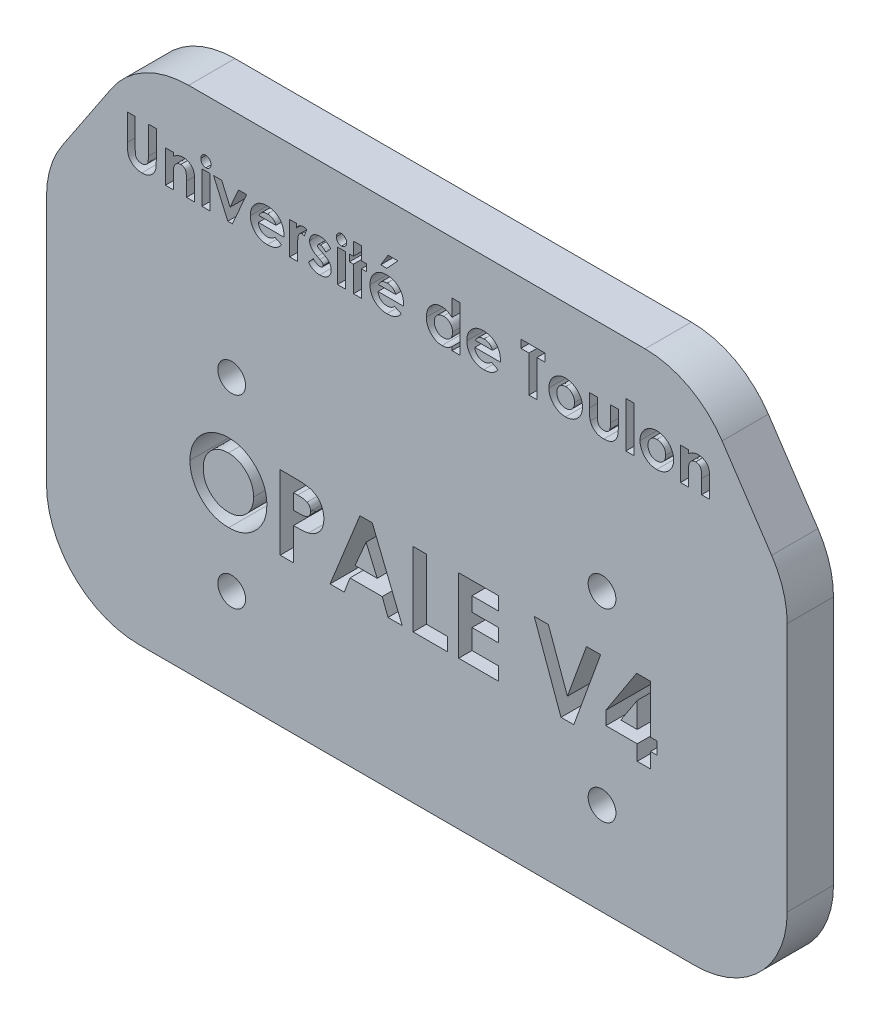
from build123d import *

# Parameters (mm, degrees)
ESQUISSE1_R             = 1.5
BOSS_EXTRU_1_DEPTH      = 5
ESQUISSE2_W             = 0.861538461
ESQUISSE2_H             = 3.507692308
ESQUISSE2_W_2           = 0.861538462
ESQUISSE2_H_2           = 4.923076923
ENL_V_MAT_EXTRU_1_DEPTH = 69.190908485
CONG_2_R                = 10


with BuildPart() as part:
    # Esquisse1 → Boss.-Extru.1 (new body)
    with BuildSketch(Plane.XY):
        Polygon((-40, 0), (40, 0), (40, 40), (30, 55), (-30, 55), (-40, 40), align=None)
        with Locations((-20, 10)):
            Circle(ESQUISSE1_R, mode=Mode.SUBTRACT)
        with Locations((20, 10)):
            Circle(ESQUISSE1_R, mode=Mode.SUBTRACT)
        with Locations((-20, 30)):
            Circle(ESQUISSE1_R, mode=Mode.SUBTRACT)
        with Locations((20, 30)):
            Circle(ESQUISSE1_R, mode=Mode.SUBTRACT)
    extrude(amount=BOSS_EXTRU_1_DEPTH)

    # Esquisse2 → Enlèv. mat.-Extru.1 (cut, through all)
    # profile 1 of 28: a face of its own
    with BuildSketch(Plane.XY.offset(5)):
        with BuildLine():
            Line((-31.27930062, 49.200709255), (-30.417762158, 49.200709255))
            Line((-30.417762158, 49.200709255), (-30.417762158, 46.077632332))
            add(Edge.make_bspline(
                [(-30.417762158, 46.077632332), (-30.417715312, 46.045253625), (-30.417624829, 45.982714487), (-30.413095204, 45.892991299), (-30.408950285, 45.810516904), (-30.401471675, 45.735381593), (-30.390423203, 45.667553225), (-30.379724678, 45.606596096), (-30.365245282, 45.553601574), (-30.343485065, 45.493279933), (-30.309959713, 45.425505275), (-30.255181149, 45.354868972), (-30.191971371, 45.290403093), (-30.116210813, 45.236744137), (-30.031062645, 45.193338879), (-29.936994719, 45.161180386), (-29.834139637, 45.143304534), (-29.76302099, 45.140575457), (-29.726416005, 45.139170793)],
                knots=[0, 0, 0, 0, 1.155499968, 2.231836252, 3.205919964, 4.102923608, 4.924856345, 5.658536265, 6.31071849, 6.882491295, 7.94666036, 8.992281882, 10.060072772, 11.158554251, 12.289267114, 13.461410017, 14.693379945, 16, 16, 16, 16], degree=3))
            add(Edge.make_bspline(
                [(-29.726416005, 45.139170793), (-29.687527725, 45.140305581), (-29.611702162, 45.142518226), (-29.502639162, 45.16423773), (-29.401591674, 45.198822618), (-29.310699218, 45.248184067), (-29.230052246, 45.307352415), (-29.161786274, 45.374822873), (-29.10791102, 45.450730011), (-29.072797134, 45.520760127), (-29.053082416, 45.585216749), (-29.038305253, 45.642806296), (-29.027471958, 45.71075626), (-29.017643636, 45.788005457), (-29.011737572, 45.87535404), (-29.005333408, 45.97209954), (-29.002986223, 46.078903915), (-29.002586162, 46.153273806), (-29.002377543, 46.192055409)],
                knots=[0, 0, 0, 0, 1.261321664, 2.459363699, 3.594844139, 4.716940403, 5.803436589, 6.833651888, 7.818396249, 8.814403945, 9.360733334, 10.004355033, 10.743453831, 11.592799886, 12.532235708, 13.585170094, 14.740740724, 16, 16, 16, 16], degree=3))
            Line((-29.002377543, 46.192055409), (-29.002377543, 49.200709255))
            Line((-29.002377543, 49.200709255), (-28.140839082, 49.200709255))
            Line((-28.140839082, 49.200709255), (-28.140839082, 46.337247716))
            add(Edge.make_bspline(
                [(-28.140839082, 46.337247716), (-28.140958722, 46.279234122), (-28.141188778, 46.167679639), (-28.144721754, 46.007367996), (-28.15224282, 45.860949026), (-28.158559647, 45.728379944), (-28.170784872, 45.609839344), (-28.183520689, 45.504821024), (-28.199753582, 45.413697143), (-28.223907152, 45.309963679), (-28.265589063, 45.190518395), (-28.332785768, 45.052982327), (-28.418087635, 44.918326186), (-28.518910179, 44.788031282), (-28.632748055, 44.666991515), (-28.757077231, 44.560734267), (-28.889922427, 44.470852093), (-29.032671781, 44.399542721), (-29.185203804, 44.343926787), (-29.349027687, 44.30655568), (-29.524031716, 44.281307291), (-29.644910307, 44.278881873), (-29.707185235, 44.277632332)],
                knots=[0, 0, 0, 0, 1.170808336, 2.251350247, 3.235597562, 4.129743112, 4.929140599, 5.639994148, 6.264258765, 6.79612947, 7.788252245, 8.809469599, 9.879094798, 10.999557536, 12.129761673, 13.226370002, 14.293821979, 15.358369427, 16.438775801, 17.562147481, 18.744053101, 20, 20, 20, 20], degree=3))
            add(Edge.make_bspline(
                [(-29.707185235, 44.277632332), (-29.748561937, 44.278329268), (-29.83019732, 44.279704308), (-29.950256472, 44.291828571), (-30.066317226, 44.309695175), (-30.178161506, 44.335760712), (-30.286177502, 44.369432516), (-30.390336516, 44.410880162), (-30.490251468, 44.45987246), (-30.585363249, 44.515958788), (-30.675554816, 44.576606496), (-30.757985252, 44.643837033), (-30.835491182, 44.712678448), (-30.905833493, 44.786027878), (-30.969540518, 44.863115281), (-31.026481052, 44.944115361), (-31.076570501, 45.029020924), (-31.121068837, 45.119362388), (-31.159155069, 45.219731483), (-31.191263194, 45.333698379), (-31.219313607, 45.463049393), (-31.240159019, 45.608075946), (-31.259057592, 45.768300047), (-31.271019346, 45.944139105), (-31.277277079, 46.135598164), (-31.278609063, 46.26833276), (-31.27930062, 46.337247716)],
                knots=[0, 0, 0, 0, 1.001158378, 1.975264943, 2.917723546, 3.841610987, 4.75185031, 5.653588123, 6.552117133, 7.442167995, 8.324307438, 9.179605724, 10.014504199, 10.831958861, 11.636465792, 12.43274043, 13.225645099, 14.020104002, 14.867201867, 15.819789774, 16.883317127, 18.068162734, 19.364263498, 20.787406516, 22.332041935, 24, 24, 24, 24], degree=3))
            Line((-31.27930062, 46.337247716), (-31.27930062, 49.200709255))
        make_face()
    # profile 2 of 28: a face of its own
    with BuildSketch(Plane.XY.offset(5)):
        with BuildLine():
            Line((-27.156223697, 47.908401563), (-26.294685235, 47.908401563))
            Line((-26.294685235, 47.908401563), (-26.294685235, 47.537247716))
            add(Edge.make_bspline(
                [(-26.294685235, 47.537247716), (-26.245534893, 47.575477865), (-26.151599035, 47.64854311), (-26.008800311, 47.74170167), (-25.874015996, 47.817948211), (-25.744241603, 47.875945232), (-25.617035422, 47.917671594), (-25.490337259, 47.947649496), (-25.362260322, 47.966845171), (-25.276161531, 47.96890896), (-25.233146774, 47.969940024)],
                knots=[0, 0, 0, 0, 1.276643801, 2.439914479, 3.493451431, 4.44993799, 5.350072675, 6.235028322, 7.118224225, 8, 8, 8, 8], degree=3))
            add(Edge.make_bspline(
                [(-25.233146774, 47.969940024), (-25.189514091, 47.968761731), (-25.103859471, 47.966448644), (-24.977737762, 47.950270469), (-24.857240718, 47.920804889), (-24.741013448, 47.881682567), (-24.630238947, 47.830043347), (-24.52356016, 47.768730151), (-24.42326851, 47.69404653), (-24.361504472, 47.63717107), (-24.330262158, 47.608401563)],
                knots=[0, 0, 0, 0, 1.048836932, 2.058954983, 3.049370783, 4.026390553, 5.001981509, 5.982488534, 6.97947532, 8, 8, 8, 8], degree=3))
            add(Edge.make_bspline(
                [(-24.330262158, 47.608401563), (-24.305204673, 47.581740642), (-24.254906311, 47.528223675), (-24.191612143, 47.436642437), (-24.137298627, 47.336802126), (-24.092796248, 47.227551049), (-24.059910782, 47.108288945), (-24.034611545, 46.980456328), (-24.020415701, 46.84333743), (-24.018663158, 46.749138041), (-24.017762158, 46.700709255)],
                knots=[0, 0, 0, 0, 0.889584746, 1.785680191, 2.700364693, 3.65222533, 4.649950538, 5.707241244, 6.821271309, 8, 8, 8, 8], degree=3))
            Line((-24.017762158, 46.700709255), (-24.017762158, 44.400709255))
            Line((-24.017762158, 44.400709255), (-24.87930062, 44.400709255))
            Line((-24.87930062, 44.400709255), (-24.87930062, 45.923786178))
            add(Edge.make_bspline(
                [(-24.87930062, 45.923786178), (-24.879482816, 45.973466294), (-24.879831962, 46.068669015), (-24.882512627, 46.204918417), (-24.887746846, 46.32796932), (-24.892517701, 46.438045765), (-24.901884786, 46.534756907), (-24.910332174, 46.618715001), (-24.923293872, 46.689158373), (-24.940159145, 46.764930789), (-24.969610064, 46.846059016), (-25.01533118, 46.931541007), (-25.073334828, 47.004159864), (-25.141251905, 47.064424681), (-25.219007405, 47.112099679), (-25.305661764, 47.14564201), (-25.400750413, 47.166546414), (-25.467007065, 47.16878004), (-25.501416005, 47.169940024)],
                knots=[0, 0, 0, 0, 1.49886392, 2.872294502, 4.110984203, 5.214877267, 6.195405875, 7.042225351, 7.75923308, 8.355011229, 9.382752534, 10.352059385, 11.267231453, 12.171456522, 13.078624015, 14.003401117, 14.963110155, 16, 16, 16, 16], degree=3))
            add(Edge.make_bspline(
                [(-25.501416005, 47.169940024), (-25.546166278, 47.167670726), (-25.633706512, 47.163231537), (-25.760315947, 47.129756004), (-25.876604604, 47.072823977), (-25.981622309, 46.9940415), (-26.074368855, 46.896774769), (-26.150757372, 46.780773035), (-26.213411647, 46.648835992), (-26.240353917, 46.55250052), (-26.25430062, 46.502632332)],
                knots=[0, 0, 0, 0, 0.984188326, 1.925263693, 2.85911992, 3.81709677, 4.80007086, 5.801799564, 6.862098548, 8, 8, 8, 8], degree=3))
            add(Edge.make_bspline(
                [(-26.25430062, 46.502632332), (-26.25776693, 46.486970893), (-26.265497497, 46.452042736), (-26.271854911, 46.393035432), (-26.280698535, 46.32302898), (-26.284012024, 46.240756458), (-26.289773816, 46.14660723), (-26.291904802, 46.040456737), (-26.294039601, 45.922513123), (-26.294462894, 45.84013399), (-26.294685235, 45.796863101)],
                knots=[0, 0, 0, 0, 0.543362196, 1.211806945, 2.009705693, 2.934833164, 4.000995085, 5.207458376, 6.533175157, 8, 8, 8, 8], degree=3))
            Line((-26.294685235, 45.796863101), (-26.294685235, 44.400709255))
            Line((-26.294685235, 44.400709255), (-27.156223697, 44.400709255))
            Line((-27.156223697, 44.400709255), (-27.156223697, 47.908401563))
        make_face()
    # profile 3 of 28: a face of its own
    with BuildSketch(Plane.XY.offset(5)):
        with BuildLine():
            add(Edge.make_bspline(
                [(-22.788916005, 49.385324639), (-22.751783703, 49.383502788), (-22.678870851, 49.379925408), (-22.574413269, 49.345053906), (-22.478542378, 49.290324126), (-22.393789853, 49.215233563), (-22.323300627, 49.125561697), (-22.26944424, 49.025168081), (-22.239443091, 48.913935188), (-22.235276375, 48.837096669), (-22.233146774, 48.797824639)],
                knots=[0, 0, 0, 0, 0.989868614, 1.943702388, 2.910836514, 3.924849579, 4.949916355, 5.946401046, 6.950409252, 8, 8, 8, 8], degree=3))
            add(Edge.make_bspline(
                [(-22.233146774, 48.797824639), (-22.235200181, 48.758842023), (-22.239201344, 48.682882539), (-22.270134735, 48.573159684), (-22.321829513, 48.472814829), (-22.392889658, 48.384474757), (-22.476723356, 48.310593572), (-22.570499394, 48.254870206), (-22.67395597, 48.221938598), (-22.745737434, 48.218062169), (-22.782185235, 48.21609387)],
                knots=[0, 0, 0, 0, 1.05296456, 2.051751585, 3.055639087, 4.085634717, 5.099016424, 6.062201612, 7.016062274, 8, 8, 8, 8], degree=3))
            add(Edge.make_bspline(
                [(-22.782185235, 48.21609387), (-22.819641671, 48.217909209), (-22.893188862, 48.221473697), (-22.998503211, 48.256426791), (-23.095652774, 48.310725538), (-23.180037645, 48.387350317), (-23.251334129, 48.47765937), (-23.302838048, 48.580390236), (-23.335055023, 48.692383737), (-23.338879149, 48.770360287), (-23.340839082, 48.810324639)],
                knots=[0, 0, 0, 0, 0.989065327, 1.942068821, 2.907541208, 3.917690034, 4.939857478, 5.938239964, 6.943311734, 8, 8, 8, 8], degree=3))
            add(Edge.make_bspline(
                [(-23.340839082, 48.810324639), (-23.33870614, 48.848645308), (-23.334516283, 48.923920728), (-23.304335423, 49.032680588), (-23.251713962, 49.131386431), (-23.181732477, 49.219416769), (-23.097724363, 49.29310661), (-23.001911026, 49.346174211), (-22.898156447, 49.379605421), (-22.825705472, 49.383398549), (-22.788916005, 49.385324639)],
                knots=[0, 0, 0, 0, 1.038616768, 2.040212704, 3.031499824, 4.052181184, 5.074969369, 6.039807101, 7.004644834, 8, 8, 8, 8], degree=3))
        make_face()
    # profile 4 of 28: a face of its own
    with BuildSketch(Plane.XY.offset(5)):
        with Locations((-22.786992928, 46.154555409)):
            Rectangle(ESQUISSE2_W, ESQUISSE2_H)
    # profile 5 of 28: a face of its own
    with BuildSketch(Plane.XY.offset(5)):
        Polygon((-21.956223697, 47.908401563), (-21.07930062, 47.908401563), (-20.171608312, 45.838209255), (-19.263916005, 47.908401563), (-18.386992928, 47.908401563), (-19.923531389, 44.400709255), (-20.419685235, 44.400709255), align=None)
    # profile 6 of 28: a face of its own
    with BuildSketch(Plane.XY.offset(5)):
        with BuildLine():
            Line((-14.359108312, 45.939170793), (-17.125454466, 45.939170793))
            add(Edge.make_bspline(
                [(-17.125454466, 45.939170793), (-17.11981411, 45.90702742), (-17.108730364, 45.843863157), (-17.084661617, 45.752111583), (-17.053946286, 45.665646448), (-17.017135896, 45.58435217), (-16.97485107, 45.507798978), (-16.925529324, 45.436345935), (-16.869796258, 45.370056155), (-16.807974108, 45.309217739), (-16.741093335, 45.254705201), (-16.669478287, 45.20694877), (-16.593055062, 45.167791419), (-16.512699823, 45.134785835), (-16.427812131, 45.108642069), (-16.338267054, 45.090611211), (-16.244301961, 45.079960317), (-16.180290069, 45.078419787), (-16.147569851, 45.077632332)],
                knots=[0, 0, 0, 0, 1.091296461, 2.144483647, 3.168565212, 4.157007626, 5.126487748, 6.090021542, 7.05641414, 8.019231907, 8.98705074, 9.938580405, 10.892824166, 11.854447369, 12.841318655, 13.858982407, 14.905600794, 16, 16, 16, 16], degree=3))
            add(Edge.make_bspline(
                [(-16.147569851, 45.077632332), (-16.108074326, 45.078675052), (-16.030296006, 45.080728475), (-15.916350188, 45.098939285), (-15.806147985, 45.126445913), (-15.700732296, 45.167350578), (-15.598882047, 45.218269696), (-15.502274005, 45.281708651), (-15.409235961, 45.355813551), (-15.352471791, 45.412933579), (-15.323531389, 45.442055409)],
                knots=[0, 0, 0, 0, 1.021034703, 2.010718019, 2.977989445, 3.954245119, 4.929443971, 5.918328161, 6.938689359, 8, 8, 8, 8], degree=3))
            Line((-15.323531389, 45.442055409), (-14.602377543, 45.098786178))
            add(Edge.make_bspline(
                [(-14.602377543, 45.098786178), (-14.625082651, 45.067411203), (-14.670071987, 45.005242845), (-14.743515569, 44.917755909), (-14.820158624, 44.836127049), (-14.900058311, 44.760893149), (-14.983315963, 44.692268597), (-15.069699979, 44.629417423), (-15.160472824, 44.574027153), (-15.253819512, 44.523418042), (-15.351669693, 44.480031086), (-15.45375257, 44.443032221), (-15.559635767, 44.409585562), (-15.670656359, 44.38410104), (-15.785889879, 44.3639277), (-15.905611987, 44.349601956), (-16.029806905, 44.340753631), (-16.114221468, 44.339704673), (-16.157185235, 44.339170793)],
                knots=[0, 0, 0, 0, 1.028154879, 2.037251081, 3.030720504, 4.000128189, 4.949298328, 5.894184978, 6.834267904, 7.770992897, 8.712077017, 9.673380525, 10.653304757, 11.658697181, 12.695551717, 13.758623199, 14.859225354, 16, 16, 16, 16], degree=3))
            add(Edge.make_bspline(
                [(-16.157185235, 44.339170793), (-16.223284287, 44.340518354), (-16.352735469, 44.343157474), (-16.542081225, 44.367652286), (-16.721907175, 44.408267325), (-16.892721087, 44.463477232), (-17.053784588, 44.536371605), (-17.205177389, 44.625527471), (-17.348412121, 44.729235532), (-17.479112164, 44.849672345), (-17.598183758, 44.980760656), (-17.702768843, 45.12154055), (-17.790284153, 45.271028452), (-17.862153486, 45.428235019), (-17.918012828, 45.593562639), (-17.958284174, 45.767083457), (-17.982970991, 45.948714596), (-17.98563729, 46.072425677), (-17.986992928, 46.135324639)],
                knots=[0, 0, 0, 0, 1.103565453, 2.161269334, 3.182010356, 4.179077853, 5.15417608, 6.128274628, 7.109042802, 8.101804412, 9.090965879, 10.063106201, 11.02526161, 11.978650795, 12.945248442, 13.93468508, 14.949922959, 16, 16, 16, 16], degree=3))
            add(Edge.make_bspline(
                [(-17.986992928, 46.135324639), (-17.985623947, 46.199821945), (-17.98293054, 46.326717498), (-17.958496727, 46.512542583), (-17.917901492, 46.689844849), (-17.861878749, 46.858868458), (-17.791099683, 47.020142044), (-17.70247089, 47.172254658), (-17.598235658, 47.315735871), (-17.479593016, 47.449914465), (-17.348339289, 47.571025305), (-17.208869802, 47.678959266), (-17.059617474, 47.768897007), (-16.902270478, 47.841566646), (-16.737835261, 47.900608894), (-16.564411182, 47.939896578), (-16.383317734, 47.966275907), (-16.259526241, 47.968705278), (-16.196608312, 47.969940024)],
                knots=[0, 0, 0, 0, 1.079208495, 2.12329425, 3.130605359, 4.119693003, 5.099659317, 6.073216462, 7.060498243, 8.06384408, 9.066070512, 10.045757761, 11.010926815, 11.975797609, 12.942977511, 13.929384301, 14.947594487, 16, 16, 16, 16], degree=3))
            add(Edge.make_bspline(
                [(-16.196608312, 47.969940024), (-16.130192602, 47.968571557), (-15.999792199, 47.965884713), (-15.809127708, 47.941588793), (-15.628107735, 47.900726089), (-15.455961032, 47.845993571), (-15.294885984, 47.77125781), (-15.141343283, 47.684295929), (-14.999015754, 47.578346139), (-14.866386337, 47.458498705), (-14.746661183, 47.32553213), (-14.642008132, 47.181089705), (-14.552961266, 47.026581104), (-14.480787898, 46.86137976), (-14.424985913, 46.685981624), (-14.384677289, 46.500614486), (-14.360178773, 46.304573297), (-14.357562088, 46.17033266), (-14.356223697, 46.101670793)],
                knots=[0, 0, 0, 0, 1.080001299, 2.120471247, 3.119684163, 4.095710327, 5.052285597, 6.002875087, 6.961153713, 7.931888285, 8.906493152, 9.865905668, 10.82813294, 11.801621613, 12.7925306, 13.817193356, 14.883530496, 16, 16, 16, 16], degree=3))
            Line((-14.356223697, 46.101670793), (-14.359108312, 45.939170793))
        make_face()
        with BuildLine():
            add(Edge.make_bspline(
                [(-15.217762158, 46.61609387), (-15.234019916, 46.659966973), (-15.266344574, 46.747198129), (-15.33936463, 46.86755584), (-15.436259907, 46.971790506), (-15.548956067, 47.064070283), (-15.677718486, 47.138970313), (-15.818489634, 47.193200368), (-15.969490193, 47.225717389), (-16.07337044, 47.229531065), (-16.126416005, 47.231478486)],
                knots=[0, 0, 0, 0, 0.954238005, 1.897273737, 2.851915805, 3.847685534, 4.862635127, 5.880135777, 6.917509367, 8, 8, 8, 8], degree=3))
            add(Edge.make_bspline(
                [(-16.126416005, 47.231478486), (-16.184350398, 47.229607751), (-16.297600073, 47.225950854), (-16.46095502, 47.187058411), (-16.615043653, 47.129012601), (-16.705885578, 47.069166139), (-16.751416005, 47.039170793)],
                knots=[0, 0, 0, 0, 1.044195649, 2.041185066, 3.018232172, 4, 4, 4, 4], degree=3))
            add(Edge.make_bspline(
                [(-16.751416005, 47.039170793), (-16.77982359, 47.016325681), (-16.840387111, 46.967621069), (-16.919041129, 46.870459993), (-16.996515992, 46.752819741), (-17.040564723, 46.663463659), (-17.063916005, 46.61609387)],
                knots=[0, 0, 0, 0, 0.82159062, 1.751589201, 2.808063854, 4, 4, 4, 4], degree=3))
            Line((-17.063916005, 46.61609387), (-15.217762158, 46.61609387))
        make_face(mode=Mode.SUBTRACT)
    # profile 7 of 28: a face of its own
    with BuildSketch(Plane.XY.offset(5)):
        with BuildLine():
            Line((-13.740839082, 47.908401563), (-13.002377543, 47.908401563))
            Line((-13.002377543, 47.908401563), (-13.002377543, 47.476670793))
            add(Edge.make_bspline(
                [(-13.002377543, 47.476670793), (-12.981487884, 47.515038826), (-12.940658178, 47.590030736), (-12.865650584, 47.690692526), (-12.779478823, 47.775467076), (-12.685239311, 47.846127525), (-12.582646428, 47.901200406), (-12.474447428, 47.940446777), (-12.361567951, 47.96595148), (-12.284565399, 47.968600936), (-12.245646774, 47.969940024)],
                knots=[0, 0, 0, 0, 1.09866127, 2.147379032, 3.14564304, 4.131443017, 5.102343063, 6.064490016, 7.021754664, 8, 8, 8, 8], degree=3))
            add(Edge.make_bspline(
                [(-12.245646774, 47.969940024), (-12.217386996, 47.968616725), (-12.159839997, 47.965922017), (-12.072130272, 47.950257633), (-11.98315505, 47.92193345), (-11.924601686, 47.896431287), (-11.894685235, 47.883401563)],
                knots=[0, 0, 0, 0, 0.931404136, 1.896671404, 2.925354185, 4, 4, 4, 4], degree=3))
            Line((-11.894685235, 47.883401563), (-12.161992928, 47.15359387))
            add(Edge.make_bspline(
                [(-12.161992928, 47.15359387), (-12.185886418, 47.16513805), (-12.230796983, 47.186836663), (-12.295999324, 47.212443262), (-12.355173152, 47.228067157), (-12.392688273, 47.230398379), (-12.410069851, 47.231478486)],
                knots=[0, 0, 0, 0, 1.214386998, 2.282580073, 3.20428172, 4, 4, 4, 4], degree=3))
            add(Edge.make_bspline(
                [(-12.410069851, 47.231478486), (-12.42648144, 47.23076275), (-12.458765864, 47.229354775), (-12.50641677, 47.217288908), (-12.551294001, 47.196481693), (-12.595560188, 47.169825586), (-12.63572322, 47.132771603), (-12.675861444, 47.089875039), (-12.711233396, 47.036913525), (-12.748561064, 46.977964671), (-12.780344238, 46.905811326), (-12.807597331, 46.819675101), (-12.831880056, 46.718559341), (-12.848589886, 46.601927171), (-12.864740608, 46.470907207), (-12.874353914, 46.324537781), (-12.881518833, 46.163281726), (-12.881956919, 46.05071918), (-12.882185235, 45.992055409)],
                knots=[0, 0, 0, 0, 0.544232178, 1.070598461, 1.618251235, 2.182094276, 2.777567932, 3.425210017, 4.127676488, 4.886675562, 5.738955394, 6.734782583, 7.883056018, 9.186093582, 10.642914445, 12.264202625, 14.053029461, 16, 16, 16, 16], degree=3))
            Line((-12.882185235, 45.992055409), (-12.87930062, 45.820901563))
            Line((-12.87930062, 45.820901563), (-12.87930062, 44.400709255))
            Line((-12.87930062, 44.400709255), (-13.740839082, 44.400709255))
            Line((-13.740839082, 44.400709255), (-13.740839082, 47.908401563))
        make_face()
    # profile 8 of 28: a face of its own
    with BuildSketch(Plane.XY.offset(5)):
        with BuildLine():
            Line((-9.310069851, 47.367055409), (-9.836992928, 46.800709255))
            add(Edge.make_bspline(
                [(-9.836992928, 46.800709255), (-9.863304721, 46.829824681), (-9.913629215, 46.885511462), (-9.990671152, 46.96142499), (-10.066565784, 47.024638535), (-10.13989882, 47.077740546), (-10.212167984, 47.118463441), (-10.282772556, 47.147762652), (-10.351746411, 47.166362227), (-10.397465199, 47.168769872), (-10.419685235, 47.169940024)],
                knots=[0, 0, 0, 0, 1.327646587, 2.539285, 3.655602211, 4.666613517, 5.598770349, 6.454635452, 7.248928967, 8, 8, 8, 8], degree=3))
            add(Edge.make_bspline(
                [(-10.419685235, 47.169940024), (-10.442169681, 47.169254775), (-10.485220399, 47.167942737), (-10.545974609, 47.156688738), (-10.599351246, 47.137205992), (-10.644517336, 47.110649193), (-10.680804571, 47.077933945), (-10.706210957, 47.040508473), (-10.723271579, 46.999536797), (-10.724714797, 46.970433033), (-10.725454466, 46.955516947)],
                knots=[0, 0, 0, 0, 1.295068245, 2.479652818, 3.543291146, 4.55379989, 5.481948265, 6.332409746, 7.145336708, 8, 8, 8, 8], degree=3))
            add(Edge.make_bspline(
                [(-10.725454466, 46.955516947), (-10.722948398, 46.932912631), (-10.717748598, 46.8860113), (-10.682033185, 46.831612753), (-10.634779114, 46.791484059), (-10.580308834, 46.754142005), (-10.506541973, 46.71238959), (-10.450580559, 46.683800492), (-10.419685235, 46.668016947)],
                knots=[0, 0, 0, 0, 0.916701701, 1.902049539, 2.5493345, 3.440293453, 4.586830489, 6, 6, 6, 6], degree=3))
            Line((-10.419685235, 46.668016947), (-10.108146774, 46.510324639))
            add(Edge.make_bspline(
                [(-10.108146774, 46.510324639), (-10.068513125, 46.49019996), (-9.991616401, 46.451154301), (-9.883506811, 46.388148888), (-9.783655069, 46.327079517), (-9.694064174, 46.26449166), (-9.614185771, 46.201472678), (-9.544587232, 46.137399396), (-9.483580442, 46.074303059), (-9.415549309, 45.98970812), (-9.347497757, 45.877034545), (-9.290763898, 45.730507811), (-9.254585406, 45.573609897), (-9.250582673, 45.465014867), (-9.248531389, 45.409363101)],
                knots=[0, 0, 0, 0, 1.076693506, 2.088987655, 3.030641824, 3.911722491, 4.735175175, 5.493635918, 6.202154166, 6.859459289, 8.120623445, 9.372284821, 10.653373066, 12, 12, 12, 12], degree=3))
            add(Edge.make_bspline(
                [(-9.248531389, 45.409363101), (-9.249767301, 45.371818053), (-9.252186307, 45.29833243), (-9.267478757, 45.190168599), (-9.294947957, 45.087320811), (-9.331097382, 44.988185873), (-9.379789574, 44.894556448), (-9.438904281, 44.805978652), (-9.50750806, 44.721289508), (-9.587414551, 44.643386065), (-9.674950775, 44.570780908), (-9.772262061, 44.509714758), (-9.875045726, 44.456023576), (-9.986017151, 44.414095544), (-10.103619271, 44.38010305), (-10.228860178, 44.356547103), (-10.361314904, 44.341722742), (-10.452015897, 44.340035887), (-10.498531389, 44.339170793)],
                knots=[0, 0, 0, 0, 0.976600749, 1.911466839, 2.833459288, 3.740827163, 4.650527853, 5.570709661, 6.506801416, 7.479409329, 8.468875524, 9.458587492, 10.461481786, 11.480119772, 12.538142914, 13.641687514, 14.790552763, 16, 16, 16, 16], degree=3))
            add(Edge.make_bspline(
                [(-10.498531389, 44.339170793), (-10.560160421, 44.341133336), (-10.681132786, 44.344985633), (-10.857804166, 44.371820189), (-11.024628851, 44.418271256), (-11.181744092, 44.483343259), (-11.330112199, 44.56626283), (-11.467614308, 44.669147866), (-11.596634142, 44.789317779), (-11.671699223, 44.881482505), (-11.710069851, 44.92859387)],
                knots=[0, 0, 0, 0, 1.056901255, 2.07460411, 3.05625841, 4.019970729, 4.984811261, 5.963335951, 6.958928997, 8, 8, 8, 8], degree=3))
            Line((-11.710069851, 44.92859387), (-11.187954466, 45.508401563))
            add(Edge.make_bspline(
                [(-11.187954466, 45.508401563), (-11.162515241, 45.481569722), (-11.11201006, 45.428299744), (-11.026878734, 45.358056076), (-10.936803762, 45.29403414), (-10.840782394, 45.240276602), (-10.744741623, 45.19686981), (-10.652598427, 45.164308643), (-10.566089348, 45.143846149), (-10.509843374, 45.140675643), (-10.483146774, 45.139170793)],
                knots=[0, 0, 0, 0, 1.087861918, 2.159761696, 3.243809206, 4.338405912, 5.394481878, 6.343674753, 7.213841449, 8, 8, 8, 8], degree=3))
            add(Edge.make_bspline(
                [(-10.483146774, 45.139170793), (-10.456464624, 45.139943526), (-10.405174168, 45.141428932), (-10.33227715, 45.156880069), (-10.267665163, 45.182855713), (-10.212871793, 45.218871603), (-10.167296133, 45.260212343), (-10.135183105, 45.307196337), (-10.11394827, 45.357017254), (-10.111367424, 45.391850143), (-10.110069851, 45.409363101)],
                knots=[0, 0, 0, 0, 1.255011871, 2.412479185, 3.488767498, 4.514443302, 5.48617286, 6.365347346, 7.178144445, 8, 8, 8, 8], degree=3))
            add(Edge.make_bspline(
                [(-10.110069851, 45.409363101), (-10.111227671, 45.425855238), (-10.1136049, 45.459716774), (-10.132425496, 45.509698824), (-10.161974201, 45.559189074), (-10.202956644, 45.608327058), (-10.255918147, 45.65671408), (-10.320669174, 45.703962577), (-10.395715918, 45.752593314), (-10.451149714, 45.781619352), (-10.480262158, 45.796863101)],
                knots=[0, 0, 0, 0, 0.704666567, 1.446816302, 2.258757648, 3.165368109, 4.175243826, 5.322435858, 6.59381024, 8, 8, 8, 8], degree=3))
            Line((-10.480262158, 45.796863101), (-10.765839082, 45.94109387))
            add(Edge.make_bspline(
                [(-10.765839082, 45.94109387), (-10.830619328, 45.97583163), (-10.954973112, 46.042515104), (-11.123052943, 46.156863091), (-11.265308255, 46.278588798), (-11.381854974, 46.407038275), (-11.474719631, 46.54185106), (-11.539498959, 46.684743584), (-11.580251074, 46.834361194), (-11.584734459, 46.936671339), (-11.586992928, 46.988209255)],
                knots=[0, 0, 0, 0, 1.255999728, 2.41104856, 3.467751088, 4.449286722, 5.368722015, 6.253902015, 7.120417131, 8, 8, 8, 8], degree=3))
            add(Edge.make_bspline(
                [(-11.586992928, 46.988209255), (-11.586209709, 47.021611288), (-11.584672125, 47.087184905), (-11.568303612, 47.183484307), (-11.543574301, 47.276052513), (-11.50867858, 47.365036531), (-11.463977771, 47.450524654), (-11.409211524, 47.532137496), (-11.343711697, 47.609726682), (-11.269575214, 47.683042281), (-11.18731846, 47.749813953), (-11.099291636, 47.808989269), (-11.005755107, 47.859395634), (-10.905941233, 47.899583174), (-10.801118702, 47.931569955), (-10.690595573, 47.953312287), (-10.57484339, 47.967140486), (-10.495687356, 47.968993622), (-10.455262158, 47.969940024)],
                knots=[0, 0, 0, 0, 0.959035663, 1.882742823, 2.798841253, 3.708806893, 4.623422363, 5.566085165, 6.527241613, 7.536786942, 8.55815439, 9.567237405, 10.580975912, 11.605536372, 12.654523293, 13.725718749, 14.838518481, 16, 16, 16, 16], degree=3))
            add(Edge.make_bspline(
                [(-10.455262158, 47.969940024), (-10.399374061, 47.968099957), (-10.288446047, 47.96444775), (-10.124849042, 47.934894062), (-9.966831305, 47.885221134), (-9.814835833, 47.816780147), (-9.670817763, 47.730769276), (-9.537944121, 47.62632303), (-9.415315666, 47.506013349), (-9.34550016, 47.413834682), (-9.310069851, 47.367055409)],
                knots=[0, 0, 0, 0, 0.996590028, 1.978055413, 2.954661574, 3.945146934, 4.945404762, 5.939399542, 6.954276554, 8, 8, 8, 8], degree=3))
        make_face()
    # profile 9 of 28: a face of its own
    with BuildSketch(Plane.XY.offset(5)):
        with BuildLine():
            add(Edge.make_bspline(
                [(-8.142762158, 49.385324639), (-8.105629857, 49.383502788), (-8.032717005, 49.379925408), (-7.928259423, 49.345053906), (-7.832388532, 49.290324126), (-7.747636006, 49.215233563), (-7.67714678, 49.125561697), (-7.623290394, 49.025168081), (-7.593289245, 48.913935188), (-7.589122529, 48.837096669), (-7.586992928, 48.797824639)],
                knots=[0, 0, 0, 0, 0.989868614, 1.943702388, 2.910836514, 3.924849579, 4.949916355, 5.946401046, 6.950409252, 8, 8, 8, 8], degree=3))
            add(Edge.make_bspline(
                [(-7.586992928, 48.797824639), (-7.589046335, 48.758842023), (-7.593047497, 48.682882539), (-7.623980889, 48.573159684), (-7.675675667, 48.472814829), (-7.746735812, 48.384474757), (-7.83056951, 48.310593572), (-7.924345548, 48.254870206), (-8.027802123, 48.221938598), (-8.099583588, 48.218062169), (-8.136031389, 48.21609387)],
                knots=[0, 0, 0, 0, 1.05296456, 2.051751585, 3.055639087, 4.085634717, 5.099016424, 6.062201612, 7.016062274, 8, 8, 8, 8], degree=3))
            add(Edge.make_bspline(
                [(-8.136031389, 48.21609387), (-8.173487825, 48.217909209), (-8.247035016, 48.221473697), (-8.352349365, 48.256426791), (-8.449498928, 48.310725538), (-8.533883798, 48.387350317), (-8.605180283, 48.47765937), (-8.656684202, 48.580390236), (-8.688901177, 48.692383737), (-8.692725303, 48.770360287), (-8.694685235, 48.810324639)],
                knots=[0, 0, 0, 0, 0.989065327, 1.942068821, 2.907541208, 3.917690034, 4.939857478, 5.938239964, 6.943311734, 8, 8, 8, 8], degree=3))
            add(Edge.make_bspline(
                [(-8.694685235, 48.810324639), (-8.692552293, 48.848645308), (-8.688362437, 48.923920728), (-8.658181577, 49.032680588), (-8.605560116, 49.131386431), (-8.535578631, 49.219416769), (-8.451570517, 49.29310661), (-8.355757179, 49.346174211), (-8.2520026, 49.379605421), (-8.179551626, 49.383398549), (-8.142762158, 49.385324639)],
                knots=[0, 0, 0, 0, 1.038616768, 2.040212704, 3.031499824, 4.052181184, 5.074969369, 6.039807101, 7.004644834, 8, 8, 8, 8], degree=3))
        make_face()
    # profile 10 of 28: a face of its own
    with BuildSketch(Plane.XY.offset(5)):
        with Locations((-8.140839082, 46.154555409)):
            Rectangle(ESQUISSE2_W, ESQUISSE2_H)
    # profile 11 of 28: a face of its own
    with BuildSketch(Plane.XY.offset(5)):
        Polygon((-6.848531389, 49.323786178), (-5.986992928, 49.323786178), (-5.986992928, 47.908401563), (-5.433146774, 47.908401563), (-5.433146774, 47.169940024), (-5.986992928, 47.169940024), (-5.986992928, 44.400709255), (-6.848531389, 44.400709255), (-6.848531389, 47.169940024), (-7.27930062, 47.169940024), (-7.27930062, 47.908401563), (-6.848531389, 47.908401563), align=None)
    # profile 12 of 28: a face of its own
    with BuildSketch(Plane.XY.offset(5)):
        with BuildLine():
            Line((-1.436031389, 45.939170793), (-4.202377543, 45.939170793))
            add(Edge.make_bspline(
                [(-4.202377543, 45.939170793), (-4.196737187, 45.90702742), (-4.185653441, 45.843863157), (-4.161584694, 45.752111583), (-4.130869363, 45.665646448), (-4.094058973, 45.58435217), (-4.051774147, 45.507798978), (-4.0024524, 45.436345935), (-3.946719335, 45.370056155), (-3.884897185, 45.309217739), (-3.818016412, 45.254705201), (-3.746401364, 45.20694877), (-3.669978139, 45.167791419), (-3.5896229, 45.134785835), (-3.504735208, 45.108642069), (-3.415190131, 45.090611211), (-3.321225038, 45.079960317), (-3.257213146, 45.078419787), (-3.224492928, 45.077632332)],
                knots=[0, 0, 0, 0, 1.091296461, 2.144483647, 3.168565212, 4.157007626, 5.126487748, 6.090021542, 7.05641414, 8.019231907, 8.98705074, 9.938580405, 10.892824166, 11.854447369, 12.841318655, 13.858982407, 14.905600794, 16, 16, 16, 16], degree=3))
            add(Edge.make_bspline(
                [(-3.224492928, 45.077632332), (-3.184997403, 45.078675052), (-3.107219083, 45.080728475), (-2.993273265, 45.098939285), (-2.883071062, 45.126445913), (-2.777655373, 45.167350578), (-2.675805123, 45.218269696), (-2.579197082, 45.281708651), (-2.486159038, 45.355813551), (-2.429394867, 45.412933579), (-2.400454466, 45.442055409)],
                knots=[0, 0, 0, 0, 1.021034703, 2.010718019, 2.977989445, 3.954245119, 4.929443971, 5.918328161, 6.938689359, 8, 8, 8, 8], degree=3))
            Line((-2.400454466, 45.442055409), (-1.67930062, 45.098786178))
            add(Edge.make_bspline(
                [(-1.67930062, 45.098786178), (-1.702005728, 45.067411203), (-1.746995064, 45.005242845), (-1.820438646, 44.917755909), (-1.897081701, 44.836127049), (-1.976981388, 44.760893149), (-2.06023904, 44.692268597), (-2.146623056, 44.629417423), (-2.237395901, 44.574027153), (-2.330742589, 44.523418042), (-2.42859277, 44.480031086), (-2.530675647, 44.443032221), (-2.636558844, 44.409585562), (-2.747579436, 44.38410104), (-2.862812956, 44.3639277), (-2.982535064, 44.349601956), (-3.106729982, 44.340753631), (-3.191144545, 44.339704673), (-3.234108312, 44.339170793)],
                knots=[0, 0, 0, 0, 1.028154879, 2.037251081, 3.030720504, 4.000128189, 4.949298328, 5.894184978, 6.834267904, 7.770992897, 8.712077017, 9.673380525, 10.653304757, 11.658697181, 12.695551717, 13.758623199, 14.859225354, 16, 16, 16, 16], degree=3))
            add(Edge.make_bspline(
                [(-3.234108312, 44.339170793), (-3.300207364, 44.340518354), (-3.429658546, 44.343157474), (-3.619004301, 44.367652286), (-3.798830252, 44.408267325), (-3.969644164, 44.463477232), (-4.130707665, 44.536371605), (-4.282100466, 44.625527471), (-4.425335198, 44.729235532), (-4.55603524, 44.849672345), (-4.675106835, 44.980760656), (-4.77969192, 45.12154055), (-4.86720723, 45.271028452), (-4.939076563, 45.428235019), (-4.994935905, 45.593562639), (-5.035207251, 45.767083457), (-5.059894068, 45.948714596), (-5.062560367, 46.072425677), (-5.063916005, 46.135324639)],
                knots=[0, 0, 0, 0, 1.103565453, 2.161269334, 3.182010356, 4.179077853, 5.15417608, 6.128274628, 7.109042802, 8.101804412, 9.090965879, 10.063106201, 11.02526161, 11.978650795, 12.945248442, 13.93468508, 14.949922959, 16, 16, 16, 16], degree=3))
            add(Edge.make_bspline(
                [(-5.063916005, 46.135324639), (-5.062547024, 46.199821945), (-5.059853617, 46.326717498), (-5.035419804, 46.512542583), (-4.994824569, 46.689844849), (-4.938801826, 46.858868458), (-4.86802276, 47.020142044), (-4.779393967, 47.172254658), (-4.675158735, 47.315735871), (-4.556516093, 47.449914465), (-4.425262366, 47.571025305), (-4.285792879, 47.678959266), (-4.136540551, 47.768897007), (-3.979193555, 47.841566646), (-3.814758338, 47.900608894), (-3.641334259, 47.939896578), (-3.460240811, 47.966275907), (-3.336449318, 47.968705278), (-3.273531389, 47.969940024)],
                knots=[0, 0, 0, 0, 1.079208495, 2.12329425, 3.130605359, 4.119693003, 5.099659317, 6.073216462, 7.060498243, 8.06384408, 9.066070512, 10.045757761, 11.010926815, 11.975797609, 12.942977511, 13.929384301, 14.947594487, 16, 16, 16, 16], degree=3))
            add(Edge.make_bspline(
                [(-3.273531389, 47.969940024), (-3.207115679, 47.968571557), (-3.076715275, 47.965884713), (-2.886050785, 47.941588793), (-2.705030812, 47.900726089), (-2.532884109, 47.845993571), (-2.371809061, 47.77125781), (-2.21826636, 47.684295929), (-2.075938831, 47.578346139), (-1.943309414, 47.458498705), (-1.82358426, 47.32553213), (-1.718931209, 47.181089705), (-1.629884343, 47.026581104), (-1.557710974, 46.86137976), (-1.50190899, 46.685981624), (-1.461600366, 46.500614486), (-1.43710185, 46.304573297), (-1.434485165, 46.17033266), (-1.433146774, 46.101670793)],
                knots=[0, 0, 0, 0, 1.080001299, 2.120471247, 3.119684163, 4.095710327, 5.052285597, 6.002875087, 6.961153713, 7.931888285, 8.906493152, 9.865905668, 10.82813294, 11.801621613, 12.7925306, 13.817193356, 14.883530496, 16, 16, 16, 16], degree=3))
            Line((-1.433146774, 46.101670793), (-1.436031389, 45.939170793))
        make_face()
        with BuildLine():
            add(Edge.make_bspline(
                [(-2.294685235, 46.61609387), (-2.310942993, 46.659966973), (-2.343267651, 46.747198129), (-2.416287706, 46.86755584), (-2.513182984, 46.971790506), (-2.625879144, 47.064070283), (-2.754641562, 47.138970313), (-2.895412711, 47.193200368), (-3.04641327, 47.225717389), (-3.150293517, 47.229531065), (-3.203339082, 47.231478486)],
                knots=[0, 0, 0, 0, 0.954238005, 1.897273737, 2.851915805, 3.847685534, 4.862635127, 5.880135777, 6.917509367, 8, 8, 8, 8], degree=3))
            add(Edge.make_bspline(
                [(-3.203339082, 47.231478486), (-3.261273475, 47.229607751), (-3.37452315, 47.225950854), (-3.537878097, 47.187058411), (-3.69196673, 47.129012601), (-3.782808655, 47.069166139), (-3.828339082, 47.039170793)],
                knots=[0, 0, 0, 0, 1.044195649, 2.041185066, 3.018232172, 4, 4, 4, 4], degree=3))
            add(Edge.make_bspline(
                [(-3.828339082, 47.039170793), (-3.856746667, 47.016325681), (-3.917310188, 46.967621069), (-3.995964206, 46.870459993), (-4.073439069, 46.752819741), (-4.1174878, 46.663463659), (-4.140839082, 46.61609387)],
                knots=[0, 0, 0, 0, 0.82159062, 1.751589201, 2.808063854, 4, 4, 4, 4], degree=3))
            Line((-4.140839082, 46.61609387), (-2.294685235, 46.61609387))
        make_face(mode=Mode.SUBTRACT)
    # profile 13 of 28: a face of its own
    with BuildSketch(Plane.XY.offset(5)):
        Polygon((-3.109108312, 49.877632332), (-2.048531389, 49.877632332), (-3.250454466, 48.585324639), (-3.894685235, 48.585324639), align=None)
    # profile 14 of 28: a face of its own
    with BuildSketch(Plane.XY.offset(5)):
        with BuildLine():
            Line((3.797622457, 49.323786178), (4.659160918, 49.323786178))
            Line((4.659160918, 49.323786178), (4.659160918, 44.400709255))
            Line((4.659160918, 44.400709255), (3.797622457, 44.400709255))
            Line((3.797622457, 44.400709255), (3.797622457, 44.783401563))
            add(Edge.make_bspline(
                [(3.797622457, 44.783401563), (3.754933544, 44.746150702), (3.672082793, 44.673854138), (3.541536819, 44.580047507), (3.410609375, 44.502669161), (3.27867135, 44.441041528), (3.143694913, 44.395535864), (3.004708287, 44.362588701), (2.859709917, 44.343158953), (2.761142022, 44.340514027), (2.711083995, 44.339170793)],
                knots=[0, 0, 0, 0, 1.129196829, 2.191548051, 3.199897424, 4.157751732, 5.089409408, 6.034969131, 7.002052659, 8, 8, 8, 8], degree=3))
            add(Edge.make_bspline(
                [(2.711083995, 44.339170793), (2.654891635, 44.340434946), (2.543852346, 44.342932982), (2.380914517, 44.369228849), (2.223581844, 44.409480534), (2.071982038, 44.4664417), (1.926390921, 44.540252203), (1.785694279, 44.628986225), (1.652304082, 44.735758862), (1.525109901, 44.855950332), (1.408651671, 44.988161804), (1.306842788, 45.130558201), (1.221025466, 45.281119945), (1.150719926, 45.439347854), (1.09541554, 45.605125798), (1.055991426, 45.778979573), (1.032731153, 45.960971273), (1.029852187, 46.084936891), (1.028391688, 46.147824639)],
                knots=[0, 0, 0, 0, 0.980476535, 1.937477201, 2.874147792, 3.812856188, 4.758993464, 5.720109578, 6.712210464, 7.737600662, 8.772720504, 9.783789959, 10.789002326, 11.793715968, 12.802552247, 13.835794126, 14.902098527, 16, 16, 16, 16], degree=3))
            add(Edge.make_bspline(
                [(1.028391688, 46.147824639), (1.029924487, 46.212944986), (1.032931244, 46.340685801), (1.054925493, 46.528139374), (1.093622084, 46.70630384), (1.146387667, 46.875425981), (1.214261426, 47.035535018), (1.296927131, 47.186893258), (1.395509369, 47.329105076), (1.509107923, 47.459749927), (1.63176646, 47.579492243), (1.76298941, 47.683737425), (1.900724734, 47.772298558), (2.045118799, 47.84459881), (2.196150986, 47.900468785), (2.35322502, 47.9413143), (2.517038202, 47.965823043), (2.628629068, 47.9685563), (2.685122457, 47.969940024)],
                knots=[0, 0, 0, 0, 1.136281865, 2.228943489, 3.287578264, 4.313574083, 5.316051562, 6.317280042, 7.318008486, 8.329309503, 9.333984563, 10.305318864, 11.248632312, 12.186624717, 13.117503092, 14.05354244, 15.014596925, 16, 16, 16, 16], degree=3))
            add(Edge.make_bspline(
                [(2.685122457, 47.969940024), (2.737419903, 47.968280792), (2.840838103, 47.96499966), (2.9936046, 47.944345754), (3.140594983, 47.905456252), (3.283594446, 47.855349987), (3.420745866, 47.787924045), (3.552786097, 47.706929347), (3.680063042, 47.611337281), (3.757940588, 47.537414478), (3.797622457, 47.499747716)],
                knots=[0, 0, 0, 0, 1.011899165, 2.001030639, 2.974036179, 3.948778736, 4.92769327, 5.924124564, 6.942254589, 8, 8, 8, 8], degree=3))
            Line((3.797622457, 47.499747716), (3.797622457, 49.323786178))
        make_face()
        with BuildLine():
            add(Edge.make_bspline(
                [(2.865891688, 47.169940024), (2.83156192, 47.168886668), (2.764277816, 47.16682216), (2.665327333, 47.154403997), (2.570760356, 47.13252264), (2.481251328, 47.100197635), (2.395466236, 47.060821068), (2.31470774, 47.011502567), (2.238309316, 46.953209146), (2.16672027, 46.887352089), (2.101456308, 46.814963143), (2.045194963, 46.735971118), (1.997381909, 46.652504401), (1.956944492, 46.564312037), (1.928000476, 46.470350436), (1.905076827, 46.371842813), (1.893180937, 46.26798441), (1.891024587, 46.197208122), (1.889930149, 46.161286178)],
                knots=[0, 0, 0, 0, 1.04836806, 2.054732945, 3.03993516, 4.00574415, 4.955904794, 5.917688631, 6.888591924, 7.88601754, 8.884115178, 9.859153345, 10.841239365, 11.818093293, 12.814750328, 13.83810466, 14.90274714, 16, 16, 16, 16], degree=3))
            add(Edge.make_bspline(
                [(1.889930149, 46.161286178), (1.89100787, 46.125038401), (1.893131505, 46.053612576), (1.905269172, 45.94887809), (1.927367933, 45.848931502), (1.959609193, 45.754580811), (1.998983249, 45.664552916), (2.04691033, 45.579263303), (2.105780355, 45.500219999), (2.171101529, 45.425552575), (2.244159212, 45.358877462), (2.32098993, 45.299676084), (2.402643128, 45.250142329), (2.488232928, 45.210108835), (2.57747123, 45.177484902), (2.671476812, 45.155878549), (2.769328771, 45.142066017), (2.836037035, 45.140142532), (2.869737842, 45.139170793)],
                knots=[0, 0, 0, 0, 1.099136573, 2.165835871, 3.191374663, 4.196217796, 5.183857741, 6.167377911, 7.154730987, 8.166690795, 9.170734848, 10.148332609, 11.103258353, 12.059567475, 13.009337315, 13.978056681, 14.978520572, 16, 16, 16, 16], degree=3))
            add(Edge.make_bspline(
                [(2.869737842, 45.139170793), (2.904707042, 45.140230054), (2.973265684, 45.142306782), (3.073830493, 45.154611616), (3.169667844, 45.176573202), (3.260379002, 45.209083276), (3.347349493, 45.248177197), (3.429794487, 45.296531977), (3.506819331, 45.35469163), (3.578814121, 45.421144036), (3.644783467, 45.494124082), (3.701822862, 45.574151962), (3.751506262, 45.658668164), (3.79057997, 45.74967096), (3.821609973, 45.845568226), (3.843873285, 45.94695512), (3.855983236, 46.05394095), (3.858088299, 46.126962948), (3.859160918, 46.164170793)],
                knots=[0, 0, 0, 0, 1.050008698, 2.058587853, 3.036635738, 3.995319155, 4.947022481, 5.895997462, 6.858296291, 7.838991643, 8.833936038, 9.806048392, 10.784806122, 11.771666913, 12.772873988, 13.80724452, 14.882696879, 16, 16, 16, 16], degree=3))
            add(Edge.make_bspline(
                [(3.859160918, 46.164170793), (3.858101627, 46.200738681), (3.856032523, 46.272166388), (3.843821058, 46.376918405), (3.82139969, 46.476314523), (3.791008335, 46.570537447), (3.751239493, 46.659371736), (3.701518502, 46.741832431), (3.645104796, 46.820776485), (3.578405074, 46.891784935), (3.506800296, 46.957756175), (3.428642677, 47.014157038), (3.346394606, 47.062764867), (3.259550748, 47.102673769), (3.16730697, 47.131928507), (3.071305839, 47.15457938), (2.970049539, 47.166814707), (2.901177551, 47.168881251), (2.865891688, 47.169940024)],
                knots=[0, 0, 0, 0, 1.106611376, 2.161533483, 3.185006901, 4.184773755, 5.152708835, 6.122342771, 7.094156588, 8.082475533, 9.064254463, 10.03606828, 10.992420271, 11.951521816, 12.920622147, 13.915721683, 14.932141191, 16, 16, 16, 16], degree=3))
        make_face(mode=Mode.SUBTRACT)
    # profile 15 of 28: a face of its own
    with BuildSketch(Plane.XY.offset(5)):
        with BuildLine():
            Line((9.025507072, 45.939170793), (6.259160918, 45.939170793))
            add(Edge.make_bspline(
                [(6.259160918, 45.939170793), (6.264801275, 45.90702742), (6.27588502, 45.843863157), (6.299953767, 45.752111583), (6.330669098, 45.665646448), (6.367479489, 45.58435217), (6.409764315, 45.507798978), (6.459086061, 45.436345935), (6.514819126, 45.370056155), (6.576641277, 45.309217739), (6.64352205, 45.254705201), (6.715137098, 45.20694877), (6.791560323, 45.167791419), (6.871915562, 45.134785835), (6.956803254, 45.108642069), (7.046348331, 45.090611211), (7.140313424, 45.079960317), (7.204325315, 45.078419787), (7.237045534, 45.077632332)],
                knots=[0, 0, 0, 0, 1.091296461, 2.144483647, 3.168565212, 4.157007626, 5.126487748, 6.090021542, 7.05641414, 8.019231907, 8.98705074, 9.938580405, 10.892824166, 11.854447369, 12.841318655, 13.858982407, 14.905600794, 16, 16, 16, 16], degree=3))
            add(Edge.make_bspline(
                [(7.237045534, 45.077632332), (7.276541059, 45.078675052), (7.354319379, 45.080728475), (7.468265196, 45.098939285), (7.5784674, 45.126445913), (7.683883089, 45.167350578), (7.785733338, 45.218269696), (7.88234138, 45.281708651), (7.975379423, 45.355813551), (8.032143594, 45.412933579), (8.061083995, 45.442055409)],
                knots=[0, 0, 0, 0, 1.021034703, 2.010718019, 2.977989445, 3.954245119, 4.929443971, 5.918328161, 6.938689359, 8, 8, 8, 8], degree=3))
            Line((8.061083995, 45.442055409), (8.782237842, 45.098786178))
            add(Edge.make_bspline(
                [(8.782237842, 45.098786178), (8.759532734, 45.067411203), (8.714543397, 45.005242845), (8.641099815, 44.917755909), (8.564456761, 44.836127049), (8.484557074, 44.760893149), (8.401299421, 44.692268597), (8.314915406, 44.629417423), (8.224142561, 44.574027153), (8.130795872, 44.523418042), (8.032945692, 44.480031086), (7.930862814, 44.443032221), (7.824979617, 44.409585562), (7.713959025, 44.38410104), (7.598725506, 44.3639277), (7.479003398, 44.349601956), (7.354808479, 44.340753631), (7.270393917, 44.339704673), (7.227430149, 44.339170793)],
                knots=[0, 0, 0, 0, 1.028154879, 2.037251081, 3.030720504, 4.000128189, 4.949298328, 5.894184978, 6.834267904, 7.770992897, 8.712077017, 9.673380525, 10.653304757, 11.658697181, 12.695551717, 13.758623199, 14.859225354, 16, 16, 16, 16], degree=3))
            add(Edge.make_bspline(
                [(7.227430149, 44.339170793), (7.161331098, 44.340518354), (7.031879916, 44.343157474), (6.84253416, 44.367652286), (6.66270821, 44.408267325), (6.491894298, 44.463477232), (6.330830797, 44.536371605), (6.179437995, 44.625527471), (6.036203263, 44.729235532), (5.905503221, 44.849672345), (5.786431626, 44.980760656), (5.681846541, 45.12154055), (5.594331231, 45.271028452), (5.522461899, 45.428235019), (5.466602556, 45.593562639), (5.426331211, 45.767083457), (5.401644394, 45.948714596), (5.398978095, 46.072425677), (5.397622457, 46.135324639)],
                knots=[0, 0, 0, 0, 1.103565453, 2.161269334, 3.182010356, 4.179077853, 5.15417608, 6.128274628, 7.109042802, 8.101804412, 9.090965879, 10.063106201, 11.02526161, 11.978650795, 12.945248442, 13.93468508, 14.949922959, 16, 16, 16, 16], degree=3))
            add(Edge.make_bspline(
                [(5.397622457, 46.135324639), (5.398991437, 46.199821945), (5.401684844, 46.326717498), (5.426118658, 46.512542583), (5.466713893, 46.689844849), (5.522736636, 46.858868458), (5.593515702, 47.020142044), (5.682144494, 47.172254658), (5.786379727, 47.315735871), (5.905022368, 47.449914465), (6.036276096, 47.571025305), (6.175745582, 47.678959266), (6.32499791, 47.768897007), (6.482344907, 47.841566646), (6.646780124, 47.900608894), (6.820204203, 47.939896578), (7.001297651, 47.966275907), (7.125089144, 47.968705278), (7.188007072, 47.969940024)],
                knots=[0, 0, 0, 0, 1.079208495, 2.12329425, 3.130605359, 4.119693003, 5.099659317, 6.073216462, 7.060498243, 8.06384408, 9.066070512, 10.045757761, 11.010926815, 11.975797609, 12.942977511, 13.929384301, 14.947594487, 16, 16, 16, 16], degree=3))
            add(Edge.make_bspline(
                [(7.188007072, 47.969940024), (7.254422783, 47.968571557), (7.384823186, 47.965884713), (7.575487676, 47.941588793), (7.75650765, 47.900726089), (7.928654352, 47.845993571), (8.0897294, 47.77125781), (8.243272101, 47.684295929), (8.38559963, 47.578346139), (8.518229047, 47.458498705), (8.637954202, 47.32553213), (8.742607253, 47.181089705), (8.831654119, 47.026581104), (8.903827487, 46.86137976), (8.959629472, 46.685981624), (8.999938096, 46.500614486), (9.024436611, 46.304573297), (9.027053297, 46.17033266), (9.028391688, 46.101670793)],
                knots=[0, 0, 0, 0, 1.080001299, 2.120471247, 3.119684163, 4.095710327, 5.052285597, 6.002875087, 6.961153713, 7.931888285, 8.906493152, 9.865905668, 10.82813294, 11.801621613, 12.7925306, 13.817193356, 14.883530496, 16, 16, 16, 16], degree=3))
            Line((9.028391688, 46.101670793), (9.025507072, 45.939170793))
        make_face()
        with BuildLine():
            add(Edge.make_bspline(
                [(8.166853226, 46.61609387), (8.150595468, 46.659966973), (8.118270811, 46.747198129), (8.045250755, 46.86755584), (7.948355477, 46.971790506), (7.835659318, 47.064070283), (7.706896899, 47.138970313), (7.56612575, 47.193200368), (7.415125192, 47.225717389), (7.311244945, 47.229531065), (7.25819938, 47.231478486)],
                knots=[0, 0, 0, 0, 0.954238005, 1.897273737, 2.851915805, 3.847685534, 4.862635127, 5.880135777, 6.917509367, 8, 8, 8, 8], degree=3))
            add(Edge.make_bspline(
                [(7.25819938, 47.231478486), (7.200264987, 47.229607751), (7.087015311, 47.225950854), (6.923660365, 47.187058411), (6.769571732, 47.129012601), (6.678729807, 47.069166139), (6.63319938, 47.039170793)],
                knots=[0, 0, 0, 0, 1.044195649, 2.041185066, 3.018232172, 4, 4, 4, 4], degree=3))
            add(Edge.make_bspline(
                [(6.63319938, 47.039170793), (6.604791794, 47.016325681), (6.544228274, 46.967621069), (6.465574256, 46.870459993), (6.388099393, 46.752819741), (6.344050662, 46.663463659), (6.32069938, 46.61609387)],
                knots=[0, 0, 0, 0, 0.82159062, 1.751589201, 2.808063854, 4, 4, 4, 4], degree=3))
            Line((6.32069938, 46.61609387), (8.166853226, 46.61609387))
        make_face(mode=Mode.SUBTRACT)
    # profile 16 of 28: a face of its own
    with BuildSketch(Plane.XY.offset(5)):
        Polygon((11.243776303, 49.200709255), (13.828391688, 49.200709255), (13.828391688, 48.339170793), (12.966853226, 48.339170793), (12.966853226, 44.400709255), (12.105314765, 44.400709255), (12.105314765, 48.339170793), (11.243776303, 48.339170793), align=None)
    # profile 17 of 28: a face of its own
    with BuildSketch(Plane.XY.offset(5)):
        with BuildLine():
            add(Edge.make_bspline(
                [(16.053391688, 47.969940024), (16.094123563, 47.969215172), (16.174791132, 47.967779638), (16.2949354, 47.955830123), (16.412979268, 47.936333997), (16.529601239, 47.911089918), (16.643718366, 47.875719186), (16.755929182, 47.833297463), (16.867236994, 47.784592364), (16.974879163, 47.72661626), (17.079633324, 47.663735888), (17.178946503, 47.594373678), (17.271993973, 47.519074447), (17.36050301, 47.439584067), (17.440348952, 47.352441786), (17.516634382, 47.261846485), (17.585237785, 47.16455245), (17.648754653, 47.062930511), (17.705303264, 46.957568329), (17.754405333, 46.84919884), (17.797021313, 46.73932033), (17.83038877, 46.626594402), (17.85801395, 46.512507498), (17.875447402, 46.395661568), (17.887841377, 46.277256914), (17.889231134, 46.197537157), (17.889930149, 46.157440024)],
                knots=[0, 0, 0, 0, 1.022364134, 2.024744242, 3.027414945, 4.024939316, 5.017584196, 6.023349371, 7.035562955, 8.064994934, 9.090267829, 10.101425541, 11.102933353, 12.093946398, 13.084502048, 14.067315274, 15.065326281, 16.070028806, 17.074376865, 18.064572984, 19.055292013, 20.030201733, 21.013838017, 21.999348303, 22.993720005, 24, 24, 24, 24], degree=3))
            add(Edge.make_bspline(
                [(17.889930149, 46.157440024), (17.889192455, 46.117029632), (17.887725751, 46.036684613), (17.8758958, 45.917166217), (17.85632505, 45.799770815), (17.830984082, 45.683806812), (17.795745718, 45.570758077), (17.754573451, 45.458958228), (17.704032873, 45.349931139), (17.64815654, 45.242487426), (17.584231285, 45.139788831), (17.515687267, 45.041520144), (17.439721357, 44.950259415), (17.360514604, 44.863176395), (17.274310052, 44.783215842), (17.182483686, 44.70907941), (17.085830468, 44.639860747), (16.983655359, 44.577183854), (16.877267052, 44.522111903), (16.768459765, 44.472460046), (16.656597254, 44.431121329), (16.541911025, 44.397410744), (16.424331524, 44.371309481), (16.304118336, 44.353578583), (16.181530356, 44.341246948), (16.098935402, 44.3398673), (16.057237842, 44.339170793)],
                knots=[0, 0, 0, 0, 1.012026251, 2.012137606, 3.004615893, 3.992048833, 4.982446996, 5.968083444, 6.973977695, 7.990229942, 8.999482246, 10.001782172, 10.988562221, 11.971415814, 12.948383116, 13.930088534, 14.925840678, 15.924049238, 16.929462851, 17.924729459, 18.917889337, 19.913673841, 20.916777188, 21.931792057, 22.95587778, 24, 24, 24, 24], degree=3))
            add(Edge.make_bspline(
                [(16.057237842, 44.339170793), (15.996267505, 44.340960393), (15.876094043, 44.344487721), (15.699106946, 44.368648995), (15.52908077, 44.410236883), (15.36573846, 44.468209482), (15.20886783, 44.542499207), (15.059837921, 44.634444024), (14.917166292, 44.742233801), (14.783324123, 44.864957491), (14.660706565, 44.999596492), (14.553585375, 45.143322805), (14.462630817, 45.293982214), (14.387924721, 45.451746522), (14.330266848, 45.616832067), (14.288628027, 45.7887453), (14.264437212, 45.967969444), (14.260939717, 46.089739497), (14.259160918, 46.151670793)],
                knots=[0, 0, 0, 0, 1.029999031, 2.030143771, 3.011211297, 3.982305373, 4.953580601, 5.938004764, 6.935448627, 7.970290061, 9.001484052, 10.007591832, 10.993831261, 11.969999897, 12.951306496, 13.942897864, 14.953773953, 16, 16, 16, 16], degree=3))
            add(Edge.make_bspline(
                [(14.259160918, 46.151670793), (14.261001749, 46.217799842), (14.264619865, 46.347775162), (14.293349298, 46.538191968), (14.339227103, 46.720507036), (14.405081803, 46.894210372), (14.48920539, 47.059622349), (14.591901224, 47.216394094), (14.713676835, 47.364561119), (14.806932568, 47.454177615), (14.854353226, 47.499747716)],
                knots=[0, 0, 0, 0, 1.043912699, 2.05178951, 3.033892, 4.007821512, 4.978932272, 5.95884105, 6.962068106, 8, 8, 8, 8], degree=3))
            add(Edge.make_bspline(
                [(14.854353226, 47.499747716), (14.89786642, 47.537520204), (14.983708943, 47.612037504), (15.12317479, 47.706550481), (15.26597208, 47.78818086), (15.4138123, 47.855296213), (15.567107591, 47.905900107), (15.7250724, 47.942735214), (15.887673881, 47.965360416), (15.997871699, 47.96840573), (16.053391688, 47.969940024)],
                knots=[0, 0, 0, 0, 1.048115528, 2.067714963, 3.060638214, 4.039924844, 5.017819947, 5.994373833, 6.98952318, 8, 8, 8, 8], degree=3))
        make_face()
        with BuildLine():
            add(Edge.make_bspline(
                [(16.072622457, 47.169940024), (16.039266052, 47.168831368), (15.97360361, 47.166648966), (15.876946769, 47.154936596), (15.785527712, 47.13093109), (15.697530685, 47.100402656), (15.614512363, 47.059575176), (15.534199172, 47.011797616), (15.46076722, 46.95200988), (15.3906629, 46.886427106), (15.327023804, 46.813599197), (15.27279725, 46.734253244), (15.224344624, 46.651424857), (15.187605454, 46.562081587), (15.157200279, 46.468665443), (15.136622422, 46.369667105), (15.12230167, 46.266192439), (15.121238557, 46.195311584), (15.12069938, 46.159363101)],
                knots=[0, 0, 0, 0, 1.030650113, 2.02884584, 2.99876339, 3.944280128, 4.900564847, 5.851248946, 6.823638398, 7.81794922, 8.81432732, 9.802856497, 10.78262424, 11.771747962, 12.779760563, 13.812642396, 14.89064281, 16, 16, 16, 16], degree=3))
            add(Edge.make_bspline(
                [(15.12069938, 46.159363101), (15.12133029, 46.122146894), (15.122563282, 46.049414964), (15.135331175, 45.943216566), (15.156385852, 45.842434991), (15.186297948, 45.747225923), (15.223917461, 45.656905964), (15.27007224, 45.571981871), (15.325249398, 45.492964258), (15.387806903, 45.41995043), (15.456304699, 45.353674971), (15.531359229, 45.296799851), (15.609827492, 45.247382921), (15.693517822, 45.207693499), (15.781241577, 45.177050045), (15.873259172, 45.1544883), (15.97005416, 45.142333126), (16.036053045, 45.140239399), (16.069737842, 45.139170793)],
                knots=[0, 0, 0, 0, 1.141730614, 2.231293227, 3.276944405, 4.297399982, 5.28939179, 6.275415646, 7.257752684, 8.24146775, 9.222424823, 10.176631434, 11.126518621, 12.063689483, 13.012557477, 13.974037417, 14.965980454, 16, 16, 16, 16], degree=3))
            add(Edge.make_bspline(
                [(16.069737842, 45.139170793), (16.103439485, 45.140118598), (16.169514271, 45.141976846), (16.266422927, 45.155892187), (16.358910432, 45.177792191), (16.447383416, 45.208699383), (16.531126568, 45.249238336), (16.610460463, 45.298891683), (16.686083012, 45.356557884), (16.755500055, 45.424083835), (16.819758084, 45.497325367), (16.876108533, 45.576760109), (16.923197093, 45.661684224), (16.961818143, 45.75156337), (16.991788878, 45.846274009), (17.01249499, 45.946168167), (17.026823399, 46.050936267), (17.027862469, 46.122774465), (17.028391688, 46.159363101)],
                knots=[0, 0, 0, 0, 1.031504075, 2.022346795, 2.991027682, 3.937587355, 4.885570121, 5.833146507, 6.798790848, 7.791235734, 8.792807298, 9.778388351, 10.766749885, 11.760164525, 12.768777521, 13.802286646, 14.880660483, 16, 16, 16, 16], degree=3))
            add(Edge.make_bspline(
                [(17.028391688, 46.159363101), (17.027752752, 46.195938949), (17.026498952, 46.267712628), (17.013730149, 46.372622425), (16.992882098, 46.472193698), (16.962584201, 46.566001286), (16.925188293, 46.655115385), (16.879001612, 46.739079853), (16.823552338, 46.817481144), (16.760690723, 46.8899305), (16.691166102, 46.955275965), (16.6174147, 47.013548256), (16.537750049, 47.061743917), (16.453666704, 47.101474347), (16.364940962, 47.132041241), (16.271672431, 47.154730849), (16.173575272, 47.16671306), (16.106625088, 47.168853127), (16.072622457, 47.169940024)],
                knots=[0, 0, 0, 0, 1.123894411, 2.205445421, 3.243160173, 4.246488011, 5.231014757, 6.210004299, 7.185865357, 8.177612767, 9.153374344, 10.115157457, 11.061423229, 12.009021698, 12.96873347, 13.94135618, 14.954456845, 16, 16, 16, 16], degree=3))
        make_face(mode=Mode.SUBTRACT)
    # profile 18 of 28: a face of its own
    with BuildSketch(Plane.XY.offset(5)):
        with BuildLine():
            Line((18.628391688, 47.908401563), (19.489930149, 47.908401563))
            Line((19.489930149, 47.908401563), (19.489930149, 46.224747716))
            add(Edge.make_bspline(
                [(19.489930149, 46.224747716), (19.490006654, 46.185320607), (19.490153486, 46.109650357), (19.494239339, 46.000973062), (19.499972598, 45.901592653), (19.507127317, 45.811391941), (19.517806194, 45.730587889), (19.530134507, 45.659334755), (19.544110837, 45.597119151), (19.566838114, 45.527771565), (19.60239535, 45.45188397), (19.656093071, 45.371320376), (19.721136672, 45.301656424), (19.796647372, 45.242273882), (19.88339632, 45.195479134), (19.980188343, 45.163767048), (20.085805599, 45.142453229), (20.15936786, 45.140293775), (20.197622457, 45.139170793)],
                knots=[0, 0, 0, 0, 1.267339619, 2.432334223, 3.495366327, 4.467371443, 5.340232306, 6.114347373, 6.791623365, 7.387877112, 8.457231658, 9.474542289, 10.487879852, 11.508108106, 12.54995813, 13.638205937, 14.771795776, 16, 16, 16, 16], degree=3))
            add(Edge.make_bspline(
                [(20.197622457, 45.139170793), (20.235843106, 45.140452518), (20.309595611, 45.142925798), (20.41591558, 45.162213099), (20.512935586, 45.195262531), (20.601652086, 45.240090186), (20.679448825, 45.300084365), (20.747183263, 45.371571687), (20.804214072, 45.455705328), (20.831620005, 45.518466614), (20.84569938, 45.550709255)],
                knots=[0, 0, 0, 0, 1.116871431, 2.155171802, 3.144773418, 4.104381479, 5.046960687, 6.001340237, 6.973219418, 8, 8, 8, 8], degree=3))
            add(Edge.make_bspline(
                [(20.84569938, 45.550709255), (20.850866038, 45.565031725), (20.862270838, 45.596646927), (20.872421337, 45.6511875), (20.883346295, 45.715509275), (20.891988326, 45.790923076), (20.896878292, 45.876961858), (20.902117389, 45.973734059), (20.904787327, 46.0811433), (20.905133569, 46.15647746), (20.905314765, 46.195901563)],
                knots=[0, 0, 0, 0, 0.56094539, 1.238222264, 2.041156151, 2.969685991, 4.036367568, 5.220421584, 6.545382566, 8, 8, 8, 8], degree=3))
            Line((20.905314765, 46.195901563), (20.905314765, 47.908401563))
            Line((20.905314765, 47.908401563), (21.766853226, 47.908401563))
            Line((21.766853226, 47.908401563), (21.766853226, 46.434363101))
            add(Edge.make_bspline(
                [(21.766853226, 46.434363101), (21.766704052, 46.361277148), (21.766418039, 46.221149256), (21.758221089, 46.020140348), (21.746908369, 45.83738313), (21.732339763, 45.672374415), (21.7113482, 45.525045723), (21.685579939, 45.395742542), (21.657072016, 45.283610421), (21.630929187, 45.217171365), (21.618776303, 45.186286178)],
                knots=[0, 0, 0, 0, 1.388070971, 2.661352173, 3.82033814, 4.865898334, 5.806910977, 6.645039373, 7.370126333, 8, 8, 8, 8], degree=3))
            add(Edge.make_bspline(
                [(21.618776303, 45.186286178), (21.603199436, 45.153044175), (21.572452038, 45.087427316), (21.519099588, 44.994134675), (21.461582658, 44.905747288), (21.397164571, 44.824345708), (21.3271603, 44.74910262), (21.253548645, 44.678307563), (21.173014521, 44.614843421), (21.087646473, 44.557077081), (20.996253311, 44.505798388), (20.899461009, 44.46035678), (20.796223575, 44.423375104), (20.687436197, 44.392027917), (20.572597439, 44.368650707), (20.451938628, 44.350944254), (20.325327432, 44.341793492), (20.238980941, 44.340059351), (20.194737842, 44.339170793)],
                knots=[0, 0, 0, 0, 0.997311338, 1.968606903, 2.91805772, 3.860812155, 4.785445165, 5.709667791, 6.633356648, 7.568312411, 8.508286151, 9.478643871, 10.470653671, 11.485274776, 12.552984541, 13.653035246, 14.797438149, 16, 16, 16, 16], degree=3))
            add(Edge.make_bspline(
                [(20.194737842, 44.339170793), (20.146942861, 44.339740383), (20.053424292, 44.340854878), (19.91679497, 44.354503069), (19.786585388, 44.372162054), (19.66424933, 44.402185565), (19.548078315, 44.436969304), (19.439406052, 44.481362607), (19.337788479, 44.533556554), (19.24302565, 44.593241708), (19.15585251, 44.660965023), (19.074330668, 44.73379909), (19.001091999, 44.814641746), (18.933745558, 44.900996538), (18.87304297, 44.993658232), (18.818954106, 45.09229735), (18.771433148, 45.197362554), (18.74607836, 45.27099826), (18.73319938, 45.308401563)],
                knots=[0, 0, 0, 0, 1.211240017, 2.369985978, 3.478996442, 4.539426614, 5.559871561, 6.551301256, 7.510778031, 8.453136967, 9.386094087, 10.30661716, 11.221130616, 12.147659962, 13.080758632, 14.026335491, 14.997475882, 16, 16, 16, 16], degree=3))
            add(Edge.make_bspline(
                [(18.73319938, 45.308401563), (18.72441292, 45.337450399), (18.705484836, 45.400028365), (18.685048305, 45.50402564), (18.668702424, 45.623888323), (18.652801668, 45.759734315), (18.64170901, 45.911791362), (18.634458717, 46.079817977), (18.629559918, 46.264142737), (18.62879257, 46.392372529), (18.628391688, 46.459363101)],
                knots=[0, 0, 0, 0, 0.627914866, 1.352675004, 2.190563461, 3.132055958, 4.183353232, 5.345633452, 6.613289997, 8, 8, 8, 8], degree=3))
            Line((18.628391688, 46.459363101), (18.628391688, 47.908401563))
        make_face()
    # profile 19 of 28: a face of its own
    with BuildSketch(Plane.XY.offset(5)):
        with Locations((22.997622457, 46.862247717)):
            Rectangle(ESQUISSE2_W_2, ESQUISSE2_H_2)
    # profile 20 of 28: a face of its own
    with BuildSketch(Plane.XY.offset(5)):
        with BuildLine():
            add(Edge.make_bspline(
                [(25.899545534, 47.969940024), (25.940277409, 47.969215172), (26.020944979, 47.967779638), (26.141089246, 47.955830123), (26.259133115, 47.936333997), (26.375755085, 47.911089918), (26.489872213, 47.875719186), (26.602083029, 47.833297463), (26.71339084, 47.784592364), (26.821033009, 47.72661626), (26.92578717, 47.663735888), (27.025100349, 47.594373678), (27.118147819, 47.519074447), (27.206656856, 47.439584067), (27.286502798, 47.352441786), (27.362788228, 47.261846485), (27.431391631, 47.16455245), (27.494908499, 47.062930511), (27.551457111, 46.957568329), (27.60055918, 46.84919884), (27.643175159, 46.73932033), (27.676542617, 46.626594402), (27.704167796, 46.512507498), (27.721601248, 46.395661568), (27.733995223, 46.277256914), (27.735384981, 46.197537157), (27.736083995, 46.157440024)],
                knots=[0, 0, 0, 0, 1.022364134, 2.024744242, 3.027414945, 4.024939316, 5.017584196, 6.023349371, 7.035562955, 8.064994934, 9.090267829, 10.101425541, 11.102933353, 12.093946398, 13.084502048, 14.067315274, 15.065326281, 16.070028806, 17.074376865, 18.064572984, 19.055292013, 20.030201733, 21.013838017, 21.999348303, 22.993720005, 24, 24, 24, 24], degree=3))
            add(Edge.make_bspline(
                [(27.736083995, 46.157440024), (27.735346301, 46.117029632), (27.733879598, 46.036684613), (27.722049646, 45.917166217), (27.702478896, 45.799770815), (27.677137928, 45.683806812), (27.641899564, 45.570758077), (27.600727297, 45.458958228), (27.550186719, 45.349931139), (27.494310386, 45.242487426), (27.430385131, 45.139788831), (27.361841113, 45.041520144), (27.285875203, 44.950259415), (27.20666845, 44.863176395), (27.120463898, 44.783215842), (27.028637532, 44.70907941), (26.931984314, 44.639860747), (26.829809205, 44.577183854), (26.723420898, 44.522111903), (26.614613611, 44.472460046), (26.5027511, 44.431121329), (26.388064871, 44.397410744), (26.27048537, 44.371309481), (26.150272182, 44.353578583), (26.027684202, 44.341246948), (25.945089248, 44.3398673), (25.903391688, 44.339170793)],
                knots=[0, 0, 0, 0, 1.012026251, 2.012137606, 3.004615893, 3.992048833, 4.982446996, 5.968083444, 6.973977695, 7.990229942, 8.999482246, 10.001782172, 10.988562221, 11.971415814, 12.948383116, 13.930088534, 14.925840678, 15.924049238, 16.929462851, 17.924729459, 18.917889337, 19.913673841, 20.916777188, 21.931792057, 22.95587778, 24, 24, 24, 24], degree=3))
            add(Edge.make_bspline(
                [(25.903391688, 44.339170793), (25.842421351, 44.340960393), (25.722247889, 44.344487721), (25.545260792, 44.368648995), (25.375234616, 44.410236883), (25.211892306, 44.468209482), (25.055021676, 44.542499207), (24.905991767, 44.634444024), (24.763320138, 44.742233801), (24.629477969, 44.864957491), (24.506860411, 44.999596492), (24.399739222, 45.143322805), (24.308784663, 45.293982214), (24.234078567, 45.451746522), (24.176420694, 45.616832067), (24.134781873, 45.7887453), (24.110591059, 45.967969444), (24.107093563, 46.089739497), (24.105314765, 46.151670793)],
                knots=[0, 0, 0, 0, 1.029999031, 2.030143771, 3.011211297, 3.982305373, 4.953580601, 5.938004764, 6.935448627, 7.970290061, 9.001484052, 10.007591832, 10.993831261, 11.969999897, 12.951306496, 13.942897864, 14.953773953, 16, 16, 16, 16], degree=3))
            add(Edge.make_bspline(
                [(24.105314765, 46.151670793), (24.107155595, 46.217799842), (24.110773711, 46.347775162), (24.139503144, 46.538191968), (24.185380949, 46.720507036), (24.251235649, 46.894210372), (24.335359236, 47.059622349), (24.43805507, 47.216394094), (24.559830681, 47.364561119), (24.653086415, 47.454177615), (24.700507072, 47.499747716)],
                knots=[0, 0, 0, 0, 1.043912699, 2.05178951, 3.033892, 4.007821512, 4.978932272, 5.95884105, 6.962068106, 8, 8, 8, 8], degree=3))
            add(Edge.make_bspline(
                [(24.700507072, 47.499747716), (24.744020266, 47.537520204), (24.829862789, 47.612037504), (24.969328636, 47.706550481), (25.112125927, 47.78818086), (25.259966146, 47.855296213), (25.413261437, 47.905900107), (25.571226246, 47.942735214), (25.733827727, 47.965360416), (25.844025546, 47.96840573), (25.899545534, 47.969940024)],
                knots=[0, 0, 0, 0, 1.048115528, 2.067714963, 3.060638214, 4.039924844, 5.017819947, 5.994373833, 6.98952318, 8, 8, 8, 8], degree=3))
        make_face()
        with BuildLine():
            add(Edge.make_bspline(
                [(25.918776303, 47.169940024), (25.885419898, 47.168831368), (25.819757456, 47.166648966), (25.723100616, 47.154936596), (25.631681558, 47.13093109), (25.543684531, 47.100402656), (25.46066621, 47.059575176), (25.380353018, 47.011797616), (25.306921066, 46.95200988), (25.236816746, 46.886427106), (25.17317765, 46.813599197), (25.118951097, 46.734253244), (25.07049847, 46.651424857), (25.033759301, 46.562081587), (25.003354126, 46.468665443), (24.982776268, 46.369667105), (24.968455516, 46.266192439), (24.967392403, 46.195311584), (24.966853226, 46.159363101)],
                knots=[0, 0, 0, 0, 1.030650113, 2.02884584, 2.99876339, 3.944280128, 4.900564847, 5.851248946, 6.823638398, 7.81794922, 8.81432732, 9.802856497, 10.78262424, 11.771747962, 12.779760563, 13.812642396, 14.89064281, 16, 16, 16, 16], degree=3))
            add(Edge.make_bspline(
                [(24.966853226, 46.159363101), (24.967484136, 46.122146894), (24.968717128, 46.049414964), (24.981485021, 45.943216566), (25.002539698, 45.842434991), (25.032451795, 45.747225923), (25.070071307, 45.656905964), (25.116226086, 45.571981871), (25.171403244, 45.492964258), (25.233960749, 45.41995043), (25.302458545, 45.353674971), (25.377513075, 45.296799851), (25.455981338, 45.247382921), (25.539671668, 45.207693499), (25.627395423, 45.177050045), (25.719413018, 45.1544883), (25.816208007, 45.142333126), (25.882206891, 45.140239399), (25.915891688, 45.139170793)],
                knots=[0, 0, 0, 0, 1.141730614, 2.231293227, 3.276944405, 4.297399982, 5.28939179, 6.275415646, 7.257752684, 8.24146775, 9.222424823, 10.176631434, 11.126518621, 12.063689483, 13.012557477, 13.974037417, 14.965980454, 16, 16, 16, 16], degree=3))
            add(Edge.make_bspline(
                [(25.915891688, 45.139170793), (25.949593331, 45.140118598), (26.015668117, 45.141976846), (26.112576773, 45.155892187), (26.205064278, 45.177792191), (26.293537262, 45.208699383), (26.377280414, 45.249238336), (26.456614309, 45.298891683), (26.532236858, 45.356557884), (26.601653901, 45.424083835), (26.665911931, 45.497325367), (26.722262379, 45.576760109), (26.769350939, 45.661684224), (26.80797199, 45.75156337), (26.837942724, 45.846274009), (26.858648837, 45.946168167), (26.872977245, 46.050936267), (26.874016315, 46.122774465), (26.874545534, 46.159363101)],
                knots=[0, 0, 0, 0, 1.031504075, 2.022346795, 2.991027682, 3.937587355, 4.885570121, 5.833146507, 6.798790848, 7.791235734, 8.792807298, 9.778388351, 10.766749885, 11.760164525, 12.768777521, 13.802286646, 14.880660483, 16, 16, 16, 16], degree=3))
            add(Edge.make_bspline(
                [(26.874545534, 46.159363101), (26.873906598, 46.195938949), (26.872652799, 46.267712628), (26.859883996, 46.372622425), (26.839035944, 46.472193698), (26.808738047, 46.566001286), (26.77134214, 46.655115385), (26.725155458, 46.739079853), (26.669706184, 46.817481144), (26.60684457, 46.8899305), (26.537319949, 46.955275965), (26.463568546, 47.013548256), (26.383903895, 47.061743917), (26.299820551, 47.101474347), (26.211094808, 47.132041241), (26.117826277, 47.154730849), (26.019729118, 47.16671306), (25.952778934, 47.168853127), (25.918776303, 47.169940024)],
                knots=[0, 0, 0, 0, 1.123894411, 2.205445421, 3.243160173, 4.246488011, 5.231014757, 6.210004299, 7.185865357, 8.177612767, 9.153374344, 10.115157457, 11.061423229, 12.009021698, 12.96873347, 13.94135618, 14.954456845, 16, 16, 16, 16], degree=3))
        make_face(mode=Mode.SUBTRACT)
    # profile 21 of 28: a face of its own
    with BuildSketch(Plane.XY.offset(5)):
        with BuildLine():
            Line((28.474545534, 47.908401563), (29.336083995, 47.908401563))
            Line((29.336083995, 47.908401563), (29.336083995, 47.537247716))
            add(Edge.make_bspline(
                [(29.336083995, 47.537247716), (29.385234338, 47.575477865), (29.479170196, 47.64854311), (29.62196892, 47.74170167), (29.756753235, 47.817948211), (29.886527628, 47.875945232), (30.013733809, 47.917671594), (30.140431972, 47.947649496), (30.268508909, 47.966845171), (30.3546077, 47.96890896), (30.397622457, 47.969940024)],
                knots=[0, 0, 0, 0, 1.276643801, 2.439914479, 3.493451431, 4.44993799, 5.350072675, 6.235028322, 7.118224225, 8, 8, 8, 8], degree=3))
            add(Edge.make_bspline(
                [(30.397622457, 47.969940024), (30.44125514, 47.968761731), (30.52690976, 47.966448644), (30.653031469, 47.950270469), (30.773528513, 47.920804889), (30.889755783, 47.881682567), (31.000530284, 47.830043347), (31.107209071, 47.768730151), (31.207500721, 47.69404653), (31.269264759, 47.63717107), (31.300507072, 47.608401563)],
                knots=[0, 0, 0, 0, 1.048836932, 2.058954983, 3.049370783, 4.026390553, 5.001981509, 5.982488534, 6.97947532, 8, 8, 8, 8], degree=3))
            add(Edge.make_bspline(
                [(31.300507072, 47.608401563), (31.325564558, 47.581740642), (31.375862919, 47.528223675), (31.439157088, 47.436642437), (31.493470604, 47.336802126), (31.537972983, 47.227551049), (31.570858449, 47.108288945), (31.596157686, 46.980456328), (31.61035353, 46.84333743), (31.612106073, 46.749138041), (31.613007072, 46.700709255)],
                knots=[0, 0, 0, 0, 0.889584746, 1.785680191, 2.700364693, 3.65222533, 4.649950538, 5.707241244, 6.821271309, 8, 8, 8, 8], degree=3))
            Line((31.613007072, 46.700709255), (31.613007072, 44.400709255))
            Line((31.613007072, 44.400709255), (30.751468611, 44.400709255))
            Line((30.751468611, 44.400709255), (30.751468611, 45.923786178))
            add(Edge.make_bspline(
                [(30.751468611, 45.923786178), (30.751286414, 45.973466294), (30.750937269, 46.068669015), (30.748256604, 46.204918417), (30.743022384, 46.32796932), (30.738251529, 46.438045765), (30.728884445, 46.534756907), (30.720437057, 46.618715001), (30.707475358, 46.689158373), (30.690610086, 46.764930789), (30.661159167, 46.846059016), (30.615438051, 46.931541007), (30.557434403, 47.004159864), (30.489517325, 47.064424681), (30.411761826, 47.112099679), (30.325107466, 47.14564201), (30.230018818, 47.166546414), (30.163762166, 47.16878004), (30.129353226, 47.169940024)],
                knots=[0, 0, 0, 0, 1.49886392, 2.872294502, 4.110984203, 5.214877267, 6.195405875, 7.042225351, 7.75923308, 8.355011229, 9.382752534, 10.352059385, 11.267231453, 12.171456522, 13.078624015, 14.003401117, 14.963110155, 16, 16, 16, 16], degree=3))
            add(Edge.make_bspline(
                [(30.129353226, 47.169940024), (30.084602953, 47.167670726), (29.997062719, 47.163231537), (29.870453283, 47.129756004), (29.754164626, 47.072823977), (29.649146922, 46.9940415), (29.556400376, 46.896774769), (29.480011859, 46.780773035), (29.417357583, 46.648835992), (29.390415314, 46.55250052), (29.376468611, 46.502632332)],
                knots=[0, 0, 0, 0, 0.984188326, 1.925263693, 2.85911992, 3.81709677, 4.80007086, 5.801799564, 6.862098548, 8, 8, 8, 8], degree=3))
            add(Edge.make_bspline(
                [(29.376468611, 46.502632332), (29.373002301, 46.486970893), (29.365271733, 46.452042736), (29.35891432, 46.393035432), (29.350070695, 46.32302898), (29.346757207, 46.240756458), (29.340995415, 46.14660723), (29.338864429, 46.040456737), (29.33672963, 45.922513123), (29.336306337, 45.84013399), (29.336083995, 45.796863101)],
                knots=[0, 0, 0, 0, 0.543362196, 1.211806945, 2.009705693, 2.934833164, 4.000995085, 5.207458376, 6.533175157, 8, 8, 8, 8], degree=3))
            Line((29.336083995, 45.796863101), (29.336083995, 44.400709255))
            Line((29.336083995, 44.400709255), (28.474545534, 44.400709255))
            Line((28.474545534, 44.400709255), (28.474545534, 47.908401563))
        make_face()
    # profile 22 of 28: a face of its own
    with BuildSketch(Plane.XY.offset(5)):
        with BuildLine():
            add(Edge.make_bspline(
                [(-20.336964549, 24.195857757), (-20.197874744, 24.192256472), (-19.923279967, 24.185146722), (-19.51945014, 24.125881402), (-19.130285435, 24.029317061), (-18.755961829, 23.895085641), (-18.397416586, 23.719551475), (-18.053384998, 23.507691071), (-17.725099369, 23.255505691), (-17.415923706, 22.968878404), (-17.130189633, 22.657183745), (-16.882600892, 22.321589029), (-16.671466296, 21.970789853), (-16.496477379, 21.60384624), (-16.363190747, 21.218216931), (-16.269658004, 20.815868126), (-16.209567851, 20.396914288), (-16.202656559, 20.111663829), (-16.199144036, 19.96669109)],
                knots=[0, 0, 0, 0, 1.014329547, 2.002516266, 2.970391464, 3.935626869, 4.897733899, 5.877609409, 6.878433252, 7.912639331, 8.949961323, 9.958554974, 10.949718813, 11.932905612, 12.9188844, 13.919928257, 14.942845884, 16, 16, 16, 16], degree=3))
            add(Edge.make_bspline(
                [(-16.199144036, 19.96669109), (-16.202884721, 19.823351859), (-16.210255862, 19.540897306), (-16.267204861, 19.125804293), (-16.362312707, 18.727765481), (-16.493338693, 18.345879901), (-16.665153973, 17.981997276), (-16.872171214, 17.633794264), (-17.119853207, 17.304502274), (-17.399166018, 16.994298017), (-17.706665182, 16.71272109), (-18.032355612, 16.46458191), (-18.37473347, 16.254318133), (-18.733297625, 16.08202607), (-19.108817, 15.948316545), (-19.500364017, 15.853974759), (-19.907914445, 15.796641351), (-20.185068501, 15.789318358), (-20.3257466, 15.785601346)],
                knots=[0, 0, 0, 0, 1.051557043, 2.072126891, 3.067553643, 4.050577992, 5.02905126, 6.015227836, 7.017913613, 8.04756643, 9.074058332, 10.072836633, 11.047628519, 12.017157415, 12.98668631, 13.966869689, 14.968021931, 16, 16, 16, 16], degree=3))
            add(Edge.make_bspline(
                [(-20.3257466, 15.785601346), (-20.472879023, 15.788935689), (-20.761974124, 15.795487216), (-21.185066099, 15.857789249), (-21.590424768, 15.951637874), (-21.974644887, 16.091701912), (-22.341639408, 16.266793737), (-22.688711916, 16.482429818), (-23.01574577, 16.738253798), (-23.320865051, 17.027713931), (-23.597303859, 17.344446804), (-23.841315331, 17.679046997), (-24.04714442, 18.028958459), (-24.214798658, 18.394344955), (-24.346970524, 18.772935698), (-24.440202758, 19.167036414), (-24.495277264, 19.575701906), (-24.502948823, 19.853275678), (-24.506836343, 19.99393468)],
                knots=[0, 0, 0, 0, 1.067978421, 2.098431617, 3.099715153, 4.085208694, 5.062210972, 6.048429807, 7.046490867, 8.072918869, 9.098532598, 10.095778865, 11.076610158, 12.041847152, 13.011192615, 13.984257998, 14.978533688, 16, 16, 16, 16], degree=3))
            add(Edge.make_bspline(
                [(-24.506836343, 19.99393468), (-24.505616215, 20.088562692), (-24.503191409, 20.27662051), (-24.473982063, 20.555312596), (-24.431929002, 20.828564987), (-24.36973452, 21.095288221), (-24.294184121, 21.357363907), (-24.196297907, 21.612352579), (-24.084876904, 21.862978218), (-23.954691954, 22.106280621), (-23.809938877, 22.340021203), (-23.652000382, 22.563097368), (-23.480479335, 22.772811799), (-23.295928263, 22.970542654), (-23.097711176, 23.154990233), (-22.888435417, 23.328765649), (-22.664042254, 23.487252808), (-22.429442949, 23.634322283), (-22.185960119, 23.767314659), (-21.93458496, 23.880513792), (-21.680496298, 23.979368667), (-21.420299849, 24.057389305), (-21.156784083, 24.120936298), (-20.887133867, 24.162961015), (-20.613785336, 24.192169553), (-20.429457128, 24.194625438), (-20.336964549, 24.195857757)],
                knots=[0, 0, 0, 0, 1.034744296, 2.056386356, 3.06226378, 4.057406941, 5.050368692, 6.043467995, 7.042652155, 8.049140477, 9.059438543, 10.048523776, 11.036952808, 12.020949711, 13.004946614, 13.997082645, 14.994316842, 16.007702937, 17.024872941, 18.026463647, 19.021641123, 20.005082605, 20.995858141, 21.984425357, 22.988620895, 24, 24, 24, 24], degree=3))
        make_face()
        with BuildLine():
            add(Edge.make_bspline(
                [(-20.359400446, 22.759960321), (-20.453007866, 22.757448623), (-20.637751455, 22.752491538), (-20.908736655, 22.714725253), (-21.168892017, 22.654408203), (-21.416775397, 22.567039692), (-21.653461142, 22.455841753), (-21.879368824, 22.321202924), (-22.091370089, 22.158495145), (-22.292291767, 21.976453472), (-22.473791441, 21.773617213), (-22.634152129, 21.556243666), (-22.768348196, 21.32469584), (-22.880738242, 21.081124761), (-22.965343038, 20.822791536), (-23.025604498, 20.551719716), (-23.063687491, 20.267442233), (-23.068487899, 20.073650643), (-23.070938908, 19.97470391)],
                knots=[0, 0, 0, 0, 1.033739768, 2.040188636, 3.016340934, 3.979330865, 4.937572243, 5.900995986, 6.878200029, 7.884839167, 8.891893314, 9.879764717, 10.863503415, 11.843163062, 12.837761627, 13.859916423, 14.907309254, 16, 16, 16, 16], degree=3))
            add(Edge.make_bspline(
                [(-23.070938908, 19.97470391), (-23.067689245, 19.865048673), (-23.061320445, 19.650142577), (-23.016508794, 19.336643353), (-22.93984052, 19.040574452), (-22.829133022, 18.763383901), (-22.691826681, 18.501993707), (-22.521313997, 18.259607578), (-22.320356468, 18.034774219), (-22.165540416, 17.903507139), (-22.086964549, 17.836883398)],
                knots=[0, 0, 0, 0, 1.078454662, 2.113592447, 3.107694534, 4.079536787, 5.043276885, 6.005368276, 6.987637804, 8, 8, 8, 8], degree=3))
            add(Edge.make_bspline(
                [(-22.086964549, 17.836883398), (-22.022595912, 17.787664336), (-21.895308875, 17.690335127), (-21.692131051, 17.565587778), (-21.482897901, 17.458666856), (-21.266030497, 17.372276016), (-21.041986852, 17.304322434), (-20.810797689, 17.256735657), (-20.572790584, 17.22687084), (-20.411839026, 17.223301428), (-20.330554292, 17.221498782)],
                knots=[0, 0, 0, 0, 1.023928204, 2.024787132, 3.009472467, 3.9914905, 4.972207045, 5.96565515, 6.972602802, 8, 8, 8, 8], degree=3))
            add(Edge.make_bspline(
                [(-20.330554292, 17.221498782), (-20.238556454, 17.224031776), (-20.057547814, 17.229015521), (-19.79160715, 17.266316882), (-19.536827916, 17.329444254), (-19.291628422, 17.416046336), (-19.056715714, 17.528640462), (-18.833237873, 17.667455366), (-18.620803082, 17.830786579), (-18.420137375, 18.015218857), (-18.236719434, 18.218854151), (-18.076693386, 18.437387146), (-17.938230554, 18.666002908), (-17.828177661, 18.907937144), (-17.74023032, 19.160906111), (-17.680694139, 19.426030151), (-17.642289431, 19.702216324), (-17.63748767, 19.890170775), (-17.635041472, 19.985921859)],
                knots=[0, 0, 0, 0, 1.026359118, 2.019393844, 2.989460624, 3.950973911, 4.916101784, 5.890408035, 6.881132271, 7.902007068, 8.92769091, 9.933912415, 10.920395702, 11.90457117, 12.894218921, 13.903490204, 14.931958862, 16, 16, 16, 16], degree=3))
            add(Edge.make_bspline(
                [(-17.635041472, 19.985921859), (-17.637572309, 20.081122348), (-17.642553875, 20.268509992), (-17.679920889, 20.543986092), (-17.742647923, 20.807939688), (-17.829510063, 21.060801843), (-17.940428416, 21.302820456), (-18.077590211, 21.533144447), (-18.240514166, 21.751551149), (-18.425450595, 21.956552203), (-18.626742532, 22.14493504), (-18.842849538, 22.308417099), (-19.067724699, 22.45047781), (-19.306527746, 22.561762434), (-19.55437297, 22.650422659), (-19.812772735, 22.71571332), (-20.082705746, 22.752226228), (-20.266346755, 22.75735931), (-20.359400446, 22.759960321)],
                knots=[0, 0, 0, 0, 1.055025985, 2.07665775, 3.074803781, 4.057872707, 5.035505728, 6.020516407, 7.023567878, 8.050795229, 9.077271434, 10.074415901, 11.050397877, 12.019801805, 12.988065821, 13.964604439, 14.968634123, 16, 16, 16, 16], degree=3))
        make_face(mode=Mode.SUBTRACT)
    # profile 23 of 28: a face of its own
    with BuildSketch(Plane.XY.offset(5)):
        with BuildLine():
            Line((-14.7632466, 23.990729551), (-13.160682497, 23.990729551))
            add(Edge.make_bspline(
                [(-13.160682497, 23.990729551), (-13.055973038, 23.99026085), (-12.853966542, 23.989356626), (-12.562656555, 23.978391706), (-12.293908829, 23.958741902), (-12.047785108, 23.934457852), (-11.824386592, 23.900412558), (-11.623433519, 23.861382295), (-11.444884186, 23.813832075), (-11.286725185, 23.757390623), (-11.14478259, 23.690848356), (-11.010459115, 23.619976091), (-10.886790484, 23.535392543), (-10.767534769, 23.446213768), (-10.659510024, 23.34392055), (-10.555977019, 23.235320652), (-10.461320659, 23.116107091), (-10.375102342, 22.987722915), (-10.296889043, 22.852540116), (-10.228556673, 22.710317026), (-10.173129281, 22.560828592), (-10.126632591, 22.405041834), (-10.089285997, 22.242963542), (-10.064426915, 22.073596919), (-10.047541376, 21.898124549), (-10.04605146, 21.778697943), (-10.045297882, 21.718293654)],
                knots=[0, 0, 0, 0, 1.698747864, 3.27724071, 4.728299578, 6.070144658, 7.288476769, 8.393259625, 9.389771311, 10.283485332, 11.113357557, 11.931608583, 12.74405601, 13.541433047, 14.344816069, 15.154114104, 15.974336324, 16.810834471, 17.661136416, 18.50621059, 19.367396281, 20.244825668, 21.142564693, 22.063065223, 23.020325768, 24, 24, 24, 24], degree=3))
            add(Edge.make_bspline(
                [(-10.045297882, 21.718293654), (-10.046388215, 21.651469827), (-10.048530854, 21.520152796), (-10.069535623, 21.327658138), (-10.105418405, 21.14413191), (-10.152315323, 20.968026403), (-10.21770974, 20.802238942), (-10.292419792, 20.642813787), (-10.384336852, 20.494220731), (-10.489366787, 20.354601053), (-10.604071459, 20.222819579), (-10.731173952, 20.102681251), (-10.868251636, 19.993367089), (-11.014511019, 19.893731473), (-11.170501203, 19.803975389), (-11.336109632, 19.723258368), (-11.512467175, 19.65416199), (-11.635277261, 19.618025143), (-11.697541472, 19.59970391)],
                knots=[0, 0, 0, 0, 1.102006807, 2.165578795, 3.188629044, 4.184801286, 5.166646146, 6.124351954, 7.085497154, 8.042432466, 9.003981491, 9.963833307, 10.922997304, 11.89326795, 12.880200226, 13.889073926, 14.929769137, 16, 16, 16, 16], degree=3))
            add(Edge.make_bspline(
                [(-11.697541472, 19.59970391), (-11.738552262, 19.589500359), (-11.827394841, 19.567396182), (-11.974404907, 19.544954894), (-12.143818573, 19.524321509), (-12.336183664, 19.506589613), (-12.551611082, 19.494536056), (-12.789892239, 19.485122763), (-13.051135119, 19.478278328), (-13.232793087, 19.478035457), (-13.327349164, 19.477909039)],
                knots=[0, 0, 0, 0, 0.618981996, 1.340914327, 2.176866532, 3.120127938, 4.170906482, 5.338178032, 6.614476169, 8, 8, 8, 8], degree=3))
            Line((-13.327349164, 19.477909039), (-13.327349164, 15.990729551))
            Line((-13.327349164, 15.990729551), (-14.7632466, 15.990729551))
            Line((-14.7632466, 15.990729551), (-14.7632466, 23.990729551))
        make_face()
        with BuildLine():
            Line((-13.327349164, 20.913806475), (-12.819336343, 20.913806475))
            add(Edge.make_bspline(
                [(-12.819336343, 20.913806475), (-12.72689539, 20.914392622), (-12.556802663, 20.915471142), (-12.324516064, 20.931067167), (-12.137846084, 20.954885447), (-11.990373334, 20.989046369), (-11.873929629, 21.040890091), (-11.773504224, 21.100863516), (-11.68736679, 21.176698264), (-11.612784451, 21.26335244), (-11.553158118, 21.362922432), (-11.511810362, 21.473786935), (-11.484951673, 21.593616567), (-11.482471023, 21.67701006), (-11.481195318, 21.719896218)],
                knots=[0, 0, 0, 0, 1.8619151, 3.425951444, 4.686033666, 5.651700536, 6.461346321, 7.243864085, 7.999046032, 8.762387399, 9.539336099, 10.322741239, 11.137448474, 12, 12, 12, 12], degree=3))
            add(Edge.make_bspline(
                [(-11.481195318, 21.719896218), (-11.482457901, 21.757365296), (-11.484907615, 21.830064316), (-11.502903885, 21.934987034), (-11.531584762, 22.032796652), (-11.573142251, 22.122471677), (-11.626866244, 22.203859738), (-11.692366662, 22.276928773), (-11.768803009, 22.343243617), (-11.827816337, 22.378345077), (-11.857797882, 22.396178269)],
                knots=[0, 0, 0, 0, 1.102301479, 2.1387299, 3.123554645, 4.094223062, 5.036071848, 5.982632524, 6.975082478, 8, 8, 8, 8], degree=3))
            add(Edge.make_bspline(
                [(-11.857797882, 22.396178269), (-11.883193981, 22.409021805), (-11.936962728, 22.436214202), (-12.028536116, 22.467827352), (-12.134210408, 22.494496526), (-12.254699024, 22.516631683), (-12.389521301, 22.533810864), (-12.538653183, 22.54694864), (-12.702314132, 22.552231851), (-12.81613053, 22.553941454), (-12.875426087, 22.554832116)],
                knots=[0, 0, 0, 0, 0.656809284, 1.390599849, 2.23162475, 3.173112763, 4.218524733, 5.370385145, 6.63003504, 8, 8, 8, 8], degree=3))
            Line((-12.875426087, 22.554832116), (-13.327349164, 22.554832116))
            Line((-13.327349164, 22.554832116), (-13.327349164, 20.913806475))
        make_face(mode=Mode.SUBTRACT)
    # profile 24 of 28: a face of its own
    with BuildSketch(Plane.XY.offset(5)):
        Polygon((-6.14625942, 23.990729551), (-4.814528651, 23.990729551), (-1.58375942, 15.990729551), (-3.117413266, 15.990729551), (-3.739208138, 17.631755193), (-7.224785061, 17.631755193), (-7.846579933, 15.990729551), (-9.378631215, 15.990729551), align=None)
        Polygon((-5.481195318, 21.844896218), (-6.679913266, 19.067652628), (-4.282477369, 19.067652628), align=None, mode=Mode.SUBTRACT)
    # profile 25 of 28: a face of its own
    with BuildSketch(Plane.XY.offset(5)):
        Polygon((-0.404272241, 23.990729551), (1.031625195, 23.990729551), (1.031625195, 17.426626987), (3.288035451, 17.426626987), (3.288035451, 15.990729551), (-0.404272241, 15.990729551), align=None)
    # profile 26 of 28: a face of its own
    with BuildSketch(Plane.XY.offset(5)):
        Polygon((4.518804682, 23.990729551), (8.82649699, 23.990729551), (8.82649699, 22.554832116), (5.954702118, 22.554832116), (5.954702118, 21.016370577), (8.82649699, 21.016370577), (8.82649699, 19.580473141), (5.954702118, 19.580473141), (5.954702118, 17.426626987), (8.82649699, 17.426626987), (8.82649699, 15.990729551), (4.518804682, 15.990729551), align=None)
    # profile 27 of 28: a face of its own
    with BuildSketch(Plane.XY.offset(5)):
        Polygon((12.672650836, 23.990729551), (14.206304682, 23.990729551), (16.262394426, 18.308037244), (18.323291862, 23.990729551), (19.852138016, 23.990729551), (16.95149699, 15.990729551), (15.568484169, 15.990729551), align=None)
    # profile 28 of 28: a face of its own
    with BuildSketch(Plane.XY.offset(5)):
        Polygon((23.739958528, 24.195857757), (25.2367534, 24.195857757), (25.2367534, 18.965088526), (25.954702118, 18.965088526), (25.954702118, 17.631755193), (25.2367534, 17.631755193), (25.2367534, 15.990729551), (23.800855964, 15.990729551), (23.800855964, 17.631755193), (20.41624058, 17.631755193), (20.41624058, 19.085280834), align=None)
        Polygon((23.800855964, 18.965088526), (23.800855964, 21.687844936), (22.030022631, 18.965088526), align=None, mode=Mode.SUBTRACT)
    extrude(amount=-ENL_V_MAT_EXTRU_1_DEPTH, mode=Mode.SUBTRACT)


with BuildPart() as enl_v_mat_extru_1_piece_1:
    # of the separate pieces the step leaves, piece 1, a body of its own (enl_v_mat_extru_1_pieces)
    add(part.part.solids().sort_by_distance((-40, 0, 0))[0])

    # Congé2
    cong_2_edges = [enl_v_mat_extru_1_piece_1.edges().sort_by_distance(p)[0] for p in [
        (-40, 0, 2.5),
        (40, 0, 2.5),
        (40, 40, 2.5),
        (30, 55, 2.5),
        (-30, 55, 2.5),
        (-40, 40, 2.5),
    ]]
    fillet(cong_2_edges, radius=CONG_2_R)


with BuildPart() as enl_v_mat_extru_1_piece_2:
    # of the separate pieces the step leaves, piece 2, a body of its own (enl_v_mat_extru_1_pieces)
    add(part.part.solids().sort_by_distance((-23.070938908, 19.97470391, 0))[0])


with BuildPart() as enl_v_mat_extru_1_piece_3:
    # of the separate pieces the step leaves, piece 3, a body of its own (enl_v_mat_extru_1_pieces)
    add(part.part.solids().sort_by_distance((-4.282477369, 19.067652628, 0))[0])


with BuildPart() as enl_v_mat_extru_1_piece_4:
    # of the separate pieces the step leaves, piece 4, a body of its own (enl_v_mat_extru_1_pieces)
    add(part.part.solids().sort_by_distance((1.889930149, 46.161286178, 0))[0])


with BuildPart() as enl_v_mat_extru_1_piece_5:
    # of the separate pieces the step leaves, piece 5, a body of its own (enl_v_mat_extru_1_pieces)
    add(part.part.solids().sort_by_distance((24.966853226, 46.159363101, 0))[0])


with BuildPart() as enl_v_mat_extru_1_piece_6:
    # of the separate pieces the step leaves, piece 6, a body of its own (enl_v_mat_extru_1_pieces)
    add(part.part.solids().sort_by_distance((15.12069938, 46.159363101, 0))[0])


with BuildPart() as enl_v_mat_extru_1_piece_7:
    # of the separate pieces the step leaves, piece 7, a body of its own (enl_v_mat_extru_1_pieces)
    add(part.part.solids().sort_by_distance((-13.327349164, 22.554832116, 0))[0])


with BuildPart() as enl_v_mat_extru_1_piece_8:
    # of the separate pieces the step leaves, piece 8, a body of its own (enl_v_mat_extru_1_pieces)
    add(part.part.solids().sort_by_distance((22.030022631, 18.965088526, 0))[0])


with BuildPart() as enl_v_mat_extru_1_piece_9:
    # of the separate pieces the step leaves, piece 9, a body of its own (enl_v_mat_extru_1_pieces)
    add(part.part.solids().sort_by_distance((-16.126416005, 47.231478486, 0))[0])


with BuildPart() as enl_v_mat_extru_1_piece_10:
    # of the separate pieces the step leaves, piece 10, a body of its own (enl_v_mat_extru_1_pieces)
    add(part.part.solids().sort_by_distance((7.25819938, 47.231478486, 0))[0])


with BuildPart() as enl_v_mat_extru_1_piece_11:
    # of the separate pieces the step leaves, piece 11, a body of its own (enl_v_mat_extru_1_pieces)
    add(part.part.solids().sort_by_distance((-3.203339082, 47.231478486, 0))[0])


solid = Compound([enl_v_mat_extru_1_piece_1.part, enl_v_mat_extru_1_piece_2.part, enl_v_mat_extru_1_piece_3.part, enl_v_mat_extru_1_piece_4.part, enl_v_mat_extru_1_piece_5.part, enl_v_mat_extru_1_piece_6.part, enl_v_mat_extru_1_piece_7.part, enl_v_mat_extru_1_piece_8.part, enl_v_mat_extru_1_piece_9.part, enl_v_mat_extru_1_piece_10.part, enl_v_mat_extru_1_piece_11.part])
